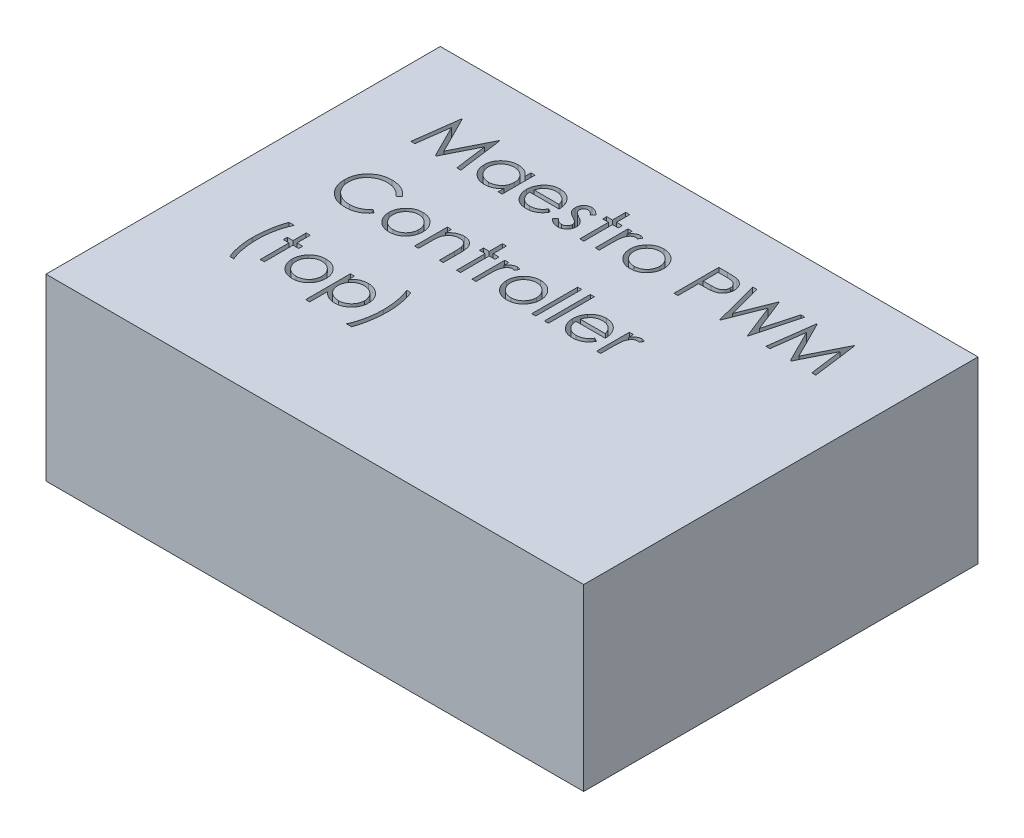
from build123d import *

# Parameters (mm, degrees)
SKETCH1_W           = 38.1
SKETCH1_H           = 27.94
BOSS_EXTRUDE1_DEPTH = 12.7
SKETCH2_W           = 0.284935898
SKETCH2_H           = 3.256410256
SKETCH2_W_2         = 0.284935897
CUT_EXTRUDE1_DEPTH  = 5.08


with BuildPart() as part:
    # Sketch1 → Boss-Extrude1 (new body)
    with BuildSketch(Plane(origin=(0, 0, 0), x_dir=(1, 0, 0), z_dir=(0, 1, 0))):
        with Locations((19.05, 13.97)):
            Rectangle(SKETCH1_W, SKETCH1_H)
    extrude(amount=BOSS_EXTRUDE1_DEPTH)

    # Sketch2 → Cut-Extrude1 (cut)
    # profile 1 of 25: a face of its own
    with BuildSketch(Plane(origin=(0, 12.7, 0), x_dir=(1, 0, 0), z_dir=(0, 1, 0))):
        Polygon((4.778778041, 21.073716255), (5.197913658, 24.248716255), (5.238618786, 24.248716255), (6.549451118, 21.64358805), (7.857103362, 24.248716255), (7.898444508, 24.248716255), (8.320124195, 21.073716255), (8.033916262, 21.073716255), (7.729899836, 23.358291576), (6.58379607, 21.073716255), (6.51955829, 21.073716255), (5.3690024, 23.363379717), (5.065621992, 21.073716255), align=None)
    # profile 2 of 25: a face of its own
    with BuildSketch(Plane(origin=(0, 12.7, 0), x_dir=(1, 0, 0), z_dir=(0, 1, 0))):
        with BuildLine():
            Line((11.250893426, 23.393908563), (11.250893426, 21.073716255))
            Line((11.250893426, 21.073716255), (10.965957528, 21.073716255))
            Line((10.965957528, 21.073716255), (10.965957528, 21.475043379))
            add(Edge.make_bspline(
                [(10.965957528, 21.475043379), (10.933827625, 21.438721747), (10.871125716, 21.367839626), (10.76640413, 21.275236513), (10.655398712, 21.198693321), (10.538648228, 21.136871612), (10.416258107, 21.090433104), (10.288499656, 21.057425659), (10.155320761, 21.036204109), (10.064377553, 21.034085003), (10.018291262, 21.033011127)],
                knots=[0, 0, 0, 0, 1.074387032, 2.096679803, 3.090159297, 4.057316773, 5.018401886, 5.985159533, 6.978961417, 8, 8, 8, 8], degree=3))
            add(Edge.make_bspline(
                [(10.018291262, 21.033011127), (9.977317476, 21.034123622), (9.896515354, 21.036317511), (9.777653263, 21.053337601), (9.663269579, 21.080670379), (9.553256217, 21.118680472), (9.448325056, 21.169100217), (9.347577683, 21.229462635), (9.251536027, 21.301345388), (9.161663988, 21.383521671), (9.07890353, 21.472779981), (9.006276519, 21.567980584), (8.945721939, 21.668711817), (8.895085152, 21.773698321), (8.856081325, 21.883748283), (8.828890957, 21.998481143), (8.811890694, 22.117761242), (8.809697712, 22.198986381), (8.808585734, 22.240172586)],
                knots=[0, 0, 0, 0, 1.033919861, 2.038935746, 3.024066025, 3.998881131, 4.97069526, 5.957263378, 6.95902576, 7.993208707, 9.027059324, 10.027763471, 11.009749337, 11.988697705, 12.965288445, 13.950418724, 14.960734635, 16, 16, 16, 16], degree=3))
            add(Edge.make_bspline(
                [(8.808585734, 22.240172586), (8.809722358, 22.280507517), (8.811969402, 22.3602475), (8.828709109, 22.477521747), (8.856858666, 22.590477598), (8.896362785, 22.698751396), (8.947019416, 22.802474156), (9.008639895, 22.901719236), (9.081228672, 22.996760047), (9.164914784, 23.085361802), (9.255569897, 23.167204788), (9.352551389, 23.238332994), (9.453446794, 23.299761849), (9.559821097, 23.348433217), (9.670099827, 23.387811476), (9.785264739, 23.415055669), (9.904836671, 23.431109667), (9.986017332, 23.43343446), (10.027195509, 23.434613691)],
                knots=[0, 0, 0, 0, 1.020392517, 2.01726096, 2.990465484, 3.961182959, 4.928053699, 5.906110375, 6.912531644, 7.948652711, 8.985773172, 9.998621852, 10.987621588, 11.969261332, 12.953316658, 13.946091881, 14.958173133, 16, 16, 16, 16], degree=3))
            add(Edge.make_bspline(
                [(10.027195509, 23.434613691), (10.074548238, 23.433309445), (10.167404706, 23.43075188), (10.3032294, 23.409467835), (10.431721176, 23.373510083), (10.55387191, 23.324599209), (10.669242961, 23.259603577), (10.776742097, 23.17761604), (10.877494356, 23.079153678), (10.935896478, 23.003524775), (10.965957528, 22.964596664)],
                knots=[0, 0, 0, 0, 1.038897134, 2.037228247, 3.008116434, 3.962042015, 4.918381754, 5.904844433, 6.921570401, 8, 8, 8, 8], degree=3))
            Line((10.965957528, 22.964596664), (10.965957528, 23.393908563))
            Line((10.965957528, 23.393908563), (11.250893426, 23.393908563))
        make_face()
        with BuildLine():
            add(Edge.make_bspline(
                [(10.031011615, 23.149677794), (9.989360751, 23.148195851), (9.907148571, 23.145270732), (9.786458655, 23.122434775), (9.670967201, 23.084439465), (9.561251834, 23.032476597), (9.459045666, 22.967136243), (9.367702121, 22.888104703), (9.286474099, 22.797538269), (9.218158745, 22.69584564), (9.162468795, 22.586826943), (9.12331013, 22.472867631), (9.097484456, 22.356023116), (9.094846012, 22.27677268), (9.093521631, 22.236992497)],
                knots=[0, 0, 0, 0, 1.031046209, 2.035121221, 3.029706178, 4.034933723, 5.034054252, 6.02443088, 7.017295772, 8.038157696, 9.050218397, 10.03989886, 11.016116709, 12, 12, 12, 12], degree=3))
            add(Edge.make_bspline(
                [(9.093521631, 22.236992497), (9.095213356, 22.197450043), (9.098590174, 22.118520127), (9.122856875, 22.001516318), (9.163569332, 21.887530152), (9.219124632, 21.777529108), (9.288690356, 21.675399245), (9.369325062, 21.58310642), (9.461808531, 21.503740865), (9.564249913, 21.437303923), (9.673658572, 21.383635065), (9.788715066, 21.346291949), (9.907256538, 21.322182105), (9.987858298, 21.319365901), (10.028467544, 21.317947025)],
                knots=[0, 0, 0, 0, 0.979072187, 1.954306742, 2.945804271, 3.96968567, 4.997920485, 5.998718438, 6.996577872, 8.005894225, 9.015743152, 10.005417472, 10.995077863, 12, 12, 12, 12], degree=3))
            add(Edge.make_bspline(
                [(10.028467544, 21.317947025), (10.069694015, 21.319452849), (10.151689375, 21.322447785), (10.272737346, 21.345381504), (10.390207777, 21.383271771), (10.502500477, 21.43579455), (10.607108681, 21.500888723), (10.700996042, 21.577095156), (10.780385527, 21.665725901), (10.847688823, 21.763131684), (10.900462237, 21.86991328), (10.938903376, 21.983609296), (10.961630848, 22.104223689), (10.96449536, 22.186650251), (10.965957528, 22.228724268)],
                knots=[0, 0, 0, 0, 1.01762866, 2.023962475, 3.030623092, 4.058876274, 5.077231937, 6.066672613, 7.034107872, 8.005628644, 8.981990164, 9.965428785, 10.961468474, 12, 12, 12, 12], degree=3))
            add(Edge.make_bspline(
                [(10.965957528, 22.228724268), (10.965086983, 22.260780729), (10.963373474, 22.323877988), (10.950282886, 22.416522236), (10.929459488, 22.505180687), (10.900116891, 22.589946555), (10.861571226, 22.670351176), (10.815082181, 22.746971873), (10.759832238, 22.819410143), (10.696710792, 22.886668501), (10.627618073, 22.948015363), (10.554507311, 23.002774353), (10.476512305, 23.047758454), (10.394944707, 23.08498875), (10.309662996, 23.114615264), (10.21997322, 23.134379815), (10.12682871, 23.147950964), (10.063286931, 23.149096123), (10.031011615, 23.149677794)],
                knots=[0, 0, 0, 0, 1.050140795, 2.067009409, 3.05949893, 4.030605086, 5.00011959, 5.97591094, 6.962425594, 7.979863591, 8.993523472, 9.986985069, 10.967611495, 11.937549037, 12.921786183, 13.919465291, 14.943216303, 16, 16, 16, 16], degree=3))
        make_face(mode=Mode.SUBTRACT)
    # profile 3 of 25: a face of its own
    with BuildSketch(Plane(origin=(0, 12.7, 0), x_dir=(1, 0, 0), z_dir=(0, 1, 0))):
        with BuildLine():
            Line((13.806412256, 21.806408563), (14.059547272, 21.673480879))
            add(Edge.make_bspline(
                [(14.059547272, 21.673480879), (14.039375503, 21.637700143), (14.00012923, 21.568084999), (13.932637123, 21.47244324), (13.861887171, 21.386402812), (13.784685715, 21.31226234), (13.703342506, 21.247627155), (13.617406455, 21.191077843), (13.52643017, 21.142891757), (13.430409348, 21.102294821), (13.328537613, 21.071080494), (13.220568094, 21.049033093), (13.106293952, 21.035404842), (13.027965632, 21.03382175), (12.987857568, 21.033011127)],
                knots=[0, 0, 0, 0, 1.120438281, 2.179929193, 3.190490725, 4.156257408, 5.095198341, 6.022838206, 6.959905092, 7.901321166, 8.864066838, 9.862729781, 10.905609505, 12, 12, 12, 12], degree=3))
            add(Edge.make_bspline(
                [(12.987857568, 21.033011127), (12.943278775, 21.034051779), (12.856318462, 21.03608179), (12.729735977, 21.053582811), (12.610556076, 21.082132736), (12.49878546, 21.122015763), (12.394697845, 21.17411055), (12.298086355, 21.237573794), (12.208442928, 21.312079482), (12.128592396, 21.39827297), (12.056706873, 21.490513032), (11.993274165, 21.586630155), (11.940244924, 21.686382509), (11.897107914, 21.789135056), (11.862269215, 21.894240159), (11.83798799, 22.002654134), (11.823991005, 22.114083556), (11.821846115, 22.189464711), (11.820765221, 22.227452233)],
                knots=[0, 0, 0, 0, 1.145258523, 2.234067595, 3.276747158, 4.290159414, 5.277019952, 6.260822364, 7.254936242, 8.264827045, 9.274100331, 10.257902744, 11.220704747, 12.172965371, 13.118907548, 14.062713208, 15.023725156, 16, 16, 16, 16], degree=3))
            add(Edge.make_bspline(
                [(11.820765221, 22.227452233), (11.821726013, 22.263098258), (11.823630177, 22.333743971), (11.835632391, 22.438306287), (11.856903343, 22.539932097), (11.886091865, 22.638705847), (11.923784782, 22.734462154), (11.969896866, 22.827259297), (12.024499952, 22.916998531), (12.066657306, 22.973607088), (12.087892625, 23.002121704)],
                knots=[0, 0, 0, 0, 1.024358464, 2.0301432, 3.019427413, 4.004406732, 4.986367066, 5.972626655, 6.978780325, 8, 8, 8, 8], degree=3))
            add(Edge.make_bspline(
                [(12.087892625, 23.002121704), (12.116656023, 23.036474179), (12.173271667, 23.10409093), (12.269026361, 23.192934983), (12.372712967, 23.267360407), (12.483032085, 23.329052595), (12.601265887, 23.375927975), (12.725825029, 23.410859853), (12.858127811, 23.430434192), (12.94857469, 23.433199012), (12.994853762, 23.434613691)],
                knots=[0, 0, 0, 0, 1.030682036, 2.02871468, 2.997146059, 3.962720338, 4.930598197, 5.918074684, 6.934738563, 8, 8, 8, 8], degree=3))
            add(Edge.make_bspline(
                [(12.994853762, 23.434613691), (13.042431233, 23.433385376), (13.135767385, 23.4309757), (13.271867952, 23.408636098), (13.400646602, 23.373209852), (13.522051802, 23.323177485), (13.636095861, 23.258625605), (13.742037492, 23.178668364), (13.841688507, 23.085760527), (13.899662718, 23.014311044), (13.929163658, 22.977953034)],
                knots=[0, 0, 0, 0, 1.056321875, 2.072262726, 3.055038591, 4.01806755, 4.982017516, 5.957941055, 6.960871419, 8, 8, 8, 8], degree=3))
            add(Edge.make_bspline(
                [(13.929163658, 22.977953034), (13.949235952, 22.950554071), (13.989246933, 22.895938521), (14.039363945, 22.806883257), (14.082868154, 22.713710075), (14.117641625, 22.614912877), (14.145798887, 22.511662258), (14.16617043, 22.403220092), (14.178117155, 22.289618672), (14.180465474, 22.212215297), (14.181662657, 22.172754717)],
                knots=[0, 0, 0, 0, 0.94817472, 1.890038105, 2.849395472, 3.817997239, 4.812318967, 5.836947057, 6.897266129, 8, 8, 8, 8], degree=3))
            Line((14.181662657, 22.172754717), (12.105701118, 22.172754717))
            add(Edge.make_bspline(
                [(12.105701118, 22.172754717), (12.107097761, 22.142183582), (12.109844203, 22.082066677), (12.122648655, 21.994100324), (12.142831471, 21.910304506), (12.171196978, 21.831307747), (12.205547616, 21.756078274), (12.247626087, 21.68517414), (12.297826968, 21.618918304), (12.353820996, 21.556718115), (12.416148147, 21.501327281), (12.481718924, 21.451750313), (12.551472373, 21.410198093), (12.624858491, 21.376470621), (12.701758611, 21.350067035), (12.782196959, 21.332044083), (12.86601525, 21.319972636), (12.923152309, 21.318630368), (12.952240581, 21.317947025)],
                knots=[0, 0, 0, 0, 1.094153842, 2.151609401, 3.174256925, 4.172055639, 5.149267565, 6.128595816, 7.11444997, 8.118368179, 9.117203808, 10.09244225, 11.054858984, 12.015122123, 12.976791628, 13.957293641, 14.960065497, 16, 16, 16, 16], degree=3))
            add(Edge.make_bspline(
                [(12.952240581, 21.317947025), (12.980680551, 21.318498619), (13.037110906, 21.319593088), (13.121149398, 21.330235607), (13.20382597, 21.347444357), (13.284798433, 21.370930277), (13.362423415, 21.399574992), (13.434310449, 21.434139728), (13.500423216, 21.472375569), (13.562215036, 21.516108632), (13.622150866, 21.569637487), (13.681607264, 21.636435605), (13.745358228, 21.715436434), (13.785263073, 21.774895717), (13.806412256, 21.806408563)],
                knots=[0, 0, 0, 0, 0.99110716, 1.966546729, 2.947904876, 3.932708344, 4.903319531, 5.828989031, 6.710028674, 7.56322171, 8.463672341, 9.504779593, 10.677557249, 12, 12, 12, 12], degree=3))
        make_face()
        with BuildLine():
            add(Edge.make_bspline(
                [(13.896726759, 22.457690614), (13.886297678, 22.495484793), (13.866225055, 22.56822642), (13.824282067, 22.668956371), (13.777045741, 22.758480395), (13.721146027, 22.836113348), (13.657810469, 22.905059392), (13.584653768, 22.965310537), (13.502615493, 23.019210653), (13.412119701, 23.064706135), (13.31628751, 23.103431935), (13.215951893, 23.129399005), (13.113573757, 23.147187661), (13.044327655, 23.148844202), (13.009482168, 23.149677794)],
                knots=[0, 0, 0, 0, 1.154881502, 2.222775134, 3.210006277, 4.132804581, 5.035138423, 5.962687519, 6.919655026, 7.923214229, 8.944639381, 9.960483929, 10.97369054, 12, 12, 12, 12], degree=3))
            add(Edge.make_bspline(
                [(13.009482168, 23.149677794), (12.981043749, 23.14912292), (12.924826973, 23.148026052), (12.842003861, 23.137621006), (12.762465848, 23.120421719), (12.685626052, 23.096867794), (12.612491407, 23.065472847), (12.541557581, 23.028658063), (12.474628222, 22.983716769), (12.432771475, 22.949464094), (12.411625597, 22.932159765)],
                knots=[0, 0, 0, 0, 1.04873581, 2.073130211, 3.073294108, 4.04793562, 5.032784715, 6.005352987, 6.992311501, 8, 8, 8, 8], degree=3))
            add(Edge.make_bspline(
                [(12.411625597, 22.932159765), (12.396482406, 22.918467064), (12.365836277, 22.890756376), (12.324887375, 22.843014167), (12.285680232, 22.791532393), (12.24999899, 22.734341458), (12.217271465, 22.672092609), (12.186646343, 22.605310897), (12.159081526, 22.533489557), (12.143572912, 22.483440273), (12.135593947, 22.457690614)],
                knots=[0, 0, 0, 0, 0.879870761, 1.780643979, 2.707998968, 3.669668524, 4.684282772, 5.740141944, 6.837334558, 8, 8, 8, 8], degree=3))
            Line((12.135593947, 22.457690614), (13.896726759, 22.457690614))
        make_face(mode=Mode.SUBTRACT)
    # profile 4 of 25: a face of its own
    with BuildSketch(Plane(origin=(0, 12.7, 0), x_dir=(1, 0, 0), z_dir=(0, 1, 0))):
        with BuildLine():
            Line((15.850572913, 23.104520542), (15.657223554, 22.905447025))
            add(Edge.make_bspline(
                [(15.657223554, 22.905447025), (15.64054074, 22.924781093), (15.608378239, 22.962054901), (15.557368253, 23.011890669), (15.506546841, 23.053743463), (15.456609703, 23.089078727), (15.40630113, 23.11579331), (15.356211497, 23.13529222), (15.306288942, 23.147358858), (15.272918752, 23.148914099), (15.256532448, 23.149677794)],
                knots=[0, 0, 0, 0, 1.26578478, 2.440284043, 3.530471711, 4.527705817, 5.468200915, 6.346673037, 7.188140097, 8, 8, 8, 8], degree=3))
            add(Edge.make_bspline(
                [(15.256532448, 23.149677794), (15.236448859, 23.148702731), (15.196927197, 23.146783944), (15.140298062, 23.127631046), (15.087728567, 23.098231691), (15.04222902, 23.056531619), (15.003686625, 23.008666889), (14.975552786, 22.955148794), (14.958347929, 22.897592355), (14.956166494, 22.857650984), (14.955060093, 22.837393138)],
                knots=[0, 0, 0, 0, 0.99966794, 1.967205029, 2.953328237, 3.988086729, 5.028030931, 6.008226631, 6.989793394, 8, 8, 8, 8], degree=3))
            add(Edge.make_bspline(
                [(14.955060093, 22.837393138), (14.956067758, 22.819057927), (14.958080248, 22.782439191), (14.97372545, 22.728420617), (14.998641101, 22.67575459), (15.021927635, 22.643493953), (15.033926278, 22.626871304)],
                knots=[0, 0, 0, 0, 0.960159726, 1.917612774, 2.927026955, 4, 4, 4, 4], degree=3))
            add(Edge.make_bspline(
                [(15.033926278, 22.626871304), (15.041150305, 22.617995288), (15.056525735, 22.599103807), (15.085380602, 22.572883883), (15.118058158, 22.543907698), (15.15735553, 22.514936424), (15.201579677, 22.484427645), (15.251689599, 22.453582853), (15.306095043, 22.420050839), (15.345045314, 22.398783387), (15.365291463, 22.387728675)],
                knots=[0, 0, 0, 0, 0.66740084, 1.420478572, 2.27185888, 3.217733974, 4.268547843, 5.408967954, 6.65319498, 8, 8, 8, 8], degree=3))
            add(Edge.make_bspline(
                [(15.365291463, 22.387728675), (15.389978065, 22.373899371), (15.437664451, 22.347185708), (15.505421461, 22.305720477), (15.566913992, 22.264507685), (15.622663061, 22.223988086), (15.671595988, 22.183027985), (15.715197404, 22.143197377), (15.752379778, 22.10329279), (15.773202268, 22.075413465), (15.783155044, 22.06208765)],
                knots=[0, 0, 0, 0, 1.27191281, 2.456916733, 3.569705269, 4.599008579, 5.553216877, 6.436649441, 7.252746552, 8, 8, 8, 8], degree=3))
            add(Edge.make_bspline(
                [(15.783155044, 22.06208765), (15.799674594, 22.03517627), (15.832551564, 21.981617629), (15.867075849, 21.893426627), (15.88708767, 21.799890671), (15.889865541, 21.735907872), (15.891278041, 21.703373707)],
                knots=[0, 0, 0, 0, 0.995354457, 1.980940102, 2.973342416, 4, 4, 4, 4], degree=3))
            add(Edge.make_bspline(
                [(15.891278041, 21.703373707), (15.890625321, 21.680450982), (15.889339065, 21.635279247), (15.88039639, 21.56875408), (15.865015805, 21.505132017), (15.844066471, 21.443722723), (15.81577779, 21.385702828), (15.782623716, 21.329608516), (15.742822904, 21.276653208), (15.69738287, 21.226906437), (15.647630172, 21.181471509), (15.594556746, 21.141535494), (15.538097236, 21.108357345), (15.478655066, 21.080902353), (15.41609518, 21.059069005), (15.350407796, 21.043953709), (15.281801711, 21.03490699), (15.235147528, 21.033651072), (15.211375197, 21.033011127)],
                knots=[0, 0, 0, 0, 1.032770009, 2.035186124, 3.017557409, 3.978232242, 4.952395191, 5.920591857, 6.910227898, 7.931268572, 8.952309245, 9.941945286, 10.918353717, 11.897095711, 12.887975737, 13.898235213, 14.929059601, 16, 16, 16, 16], degree=3))
            add(Edge.make_bspline(
                [(15.211375197, 21.033011127), (15.179292116, 21.033911648), (15.115571747, 21.035700178), (15.02132893, 21.052487819), (14.929235099, 21.078609355), (14.839987173, 21.114637381), (14.755581055, 21.160131242), (14.678355145, 21.214616413), (14.608041176, 21.276293054), (14.568019599, 21.323566908), (14.54800881, 21.347203836)],
                knots=[0, 0, 0, 0, 1.013940152, 2.01379169, 3.017749504, 4.037548394, 5.051665909, 6.043208538, 7.021604269, 8, 8, 8, 8], degree=3))
            Line((14.54800881, 21.347203836), (14.736906046, 21.562177794))
            add(Edge.make_bspline(
                [(14.736906046, 21.562177794), (14.754842449, 21.542805972), (14.789614879, 21.505250766), (14.84522384, 21.455245114), (14.901810868, 21.413333961), (14.958810905, 21.378278863), (15.017067705, 21.351268319), (15.076254798, 21.332292166), (15.136251797, 21.320096363), (15.17654902, 21.318664635), (15.196746791, 21.317947025)],
                knots=[0, 0, 0, 0, 1.179806542, 2.287233372, 3.337373186, 4.324005949, 5.273901747, 6.200048787, 7.097828587, 8, 8, 8, 8], degree=3))
            add(Edge.make_bspline(
                [(15.196746791, 21.317947025), (15.224249481, 21.319190559), (15.277985124, 21.321620215), (15.354950534, 21.343679292), (15.426014859, 21.378268605), (15.487721751, 21.427331153), (15.540247283, 21.484440851), (15.578282127, 21.548770088), (15.602118372, 21.618430909), (15.604917813, 21.666720212), (15.606342144, 21.691289372)],
                knots=[0, 0, 0, 0, 1.072336372, 2.095165389, 3.102688358, 4.141489647, 5.156069229, 6.117746104, 7.042326257, 8, 8, 8, 8], degree=3))
            add(Edge.make_bspline(
                [(15.606342144, 21.691289372), (15.60535672, 21.711527384), (15.603411132, 21.751484628), (15.588131878, 21.809315294), (15.563990219, 21.86416957), (15.540218859, 21.896273036), (15.528111976, 21.912623507)],
                knots=[0, 0, 0, 0, 1.013901739, 2.00181326, 2.98231254, 4, 4, 4, 4], degree=3))
            add(Edge.make_bspline(
                [(15.528111976, 21.912623507), (15.520834518, 21.920819871), (15.504981586, 21.938674513), (15.475902903, 21.96446012), (15.441085071, 21.992253253), (15.400136495, 22.021582623), (15.352974626, 22.052061358), (15.299408316, 22.083529556), (15.240171386, 22.11748185), (15.198288028, 22.139996823), (15.176394227, 22.151766135)],
                knots=[0, 0, 0, 0, 0.615000592, 1.339693406, 2.178160186, 3.116406724, 4.166410947, 5.330106347, 6.604359322, 8, 8, 8, 8], degree=3))
            add(Edge.make_bspline(
                [(15.176394227, 22.151766135), (15.152766204, 22.164955205), (15.106943926, 22.190533019), (15.042040312, 22.230371178), (14.98348664, 22.270890777), (14.929873976, 22.309818853), (14.882556493, 22.349207852), (14.841720597, 22.389101501), (14.805758537, 22.427890917), (14.785849099, 22.455374894), (14.776339139, 22.468502914)],
                knots=[0, 0, 0, 0, 1.262093308, 2.447601706, 3.550203992, 4.582594899, 5.537233252, 6.418365656, 7.244515135, 8, 8, 8, 8], degree=3))
            add(Edge.make_bspline(
                [(14.776339139, 22.468502914), (14.759892095, 22.494942151), (14.726992259, 22.547829863), (14.69504705, 22.636104367), (14.673088724, 22.729036669), (14.671127127, 22.793159744), (14.670124195, 22.825944821)],
                knots=[0, 0, 0, 0, 0.985009483, 1.970363186, 2.962279964, 4, 4, 4, 4], degree=3))
            add(Edge.make_bspline(
                [(14.670124195, 22.825944821), (14.670608787, 22.847376432), (14.671557201, 22.889321131), (14.679126447, 22.950951347), (14.6929075, 23.009505744), (14.710193037, 23.065863684), (14.734216905, 23.11893344), (14.762924262, 23.169422718), (14.796658569, 23.217261729), (14.835523554, 23.26171457), (14.878256011, 23.302090888), (14.924424838, 23.337286786), (14.972991685, 23.367318979), (15.02416218, 23.392505946), (15.078427894, 23.4115572), (15.135409516, 23.424672114), (15.194991707, 23.433430762), (15.235723442, 23.434213703), (15.256532448, 23.434613691)],
                knots=[0, 0, 0, 0, 1.087655834, 2.128696564, 3.144119009, 4.137814668, 5.115653402, 6.093965665, 7.082169637, 8.081268856, 9.086088321, 10.061021666, 11.022561449, 11.980240094, 12.950172527, 13.934149372, 14.944599409, 16, 16, 16, 16], degree=3))
            add(Edge.make_bspline(
                [(15.256532448, 23.434613691), (15.281199534, 23.433611897), (15.330996436, 23.431589514), (15.405703846, 23.415527924), (15.480301235, 23.389100036), (15.554980274, 23.352600025), (15.629193894, 23.30536793), (15.7035949, 23.248282066), (15.77907647, 23.181717996), (15.826208268, 23.130827985), (15.850572913, 23.104520542)],
                knots=[0, 0, 0, 0, 0.845714091, 1.707292901, 2.609013841, 3.555613372, 4.552488639, 5.621697636, 6.770543573, 8, 8, 8, 8], degree=3))
        make_face()
    # profile 5 of 25: a face of its own
    with BuildSketch(Plane(origin=(0, 12.7, 0), x_dir=(1, 0, 0), z_dir=(0, 1, 0))):
        Polygon((16.746085734, 24.330126512), (17.031021631, 24.330126512), (17.031021631, 23.393908563), (17.438072913, 23.393908563), (17.438072913, 23.108972666), (17.031021631, 23.108972666), (17.031021631, 21.073716255), (16.746085734, 21.073716255), (16.746085734, 23.108972666), (16.339034451, 23.108972666), (16.339034451, 23.393908563), (16.746085734, 23.393908563), align=None)
    # profile 6 of 25: a face of its own
    with BuildSketch(Plane(origin=(0, 12.7, 0), x_dir=(1, 0, 0), z_dir=(0, 1, 0))):
        with BuildLine():
            Line((17.845124195, 23.393908563), (18.130060093, 23.393908563))
            Line((18.130060093, 23.393908563), (18.130060093, 23.052367097))
            add(Edge.make_bspline(
                [(18.130060093, 23.052367097), (18.151095609, 23.084167741), (18.191325872, 23.144986226), (18.258194029, 23.225421949), (18.326686337, 23.292019884), (18.397130685, 23.345090934), (18.470045105, 23.384835691), (18.543829339, 23.413948659), (18.61964423, 23.431163795), (18.670591118, 23.433462185), (18.696115782, 23.434613691)],
                knots=[0, 0, 0, 0, 1.2804753, 2.448899062, 3.506932113, 4.484331642, 5.4025378, 6.288909075, 7.142734305, 8, 8, 8, 8], degree=3))
            add(Edge.make_bspline(
                [(18.696115782, 23.434613691), (18.715915378, 23.433533714), (18.756654334, 23.431311589), (18.818324254, 23.415698913), (18.881863671, 23.390772421), (18.922814266, 23.367331647), (18.944162657, 23.355111488)],
                knots=[0, 0, 0, 0, 0.901110191, 1.854092781, 2.881294221, 4, 4, 4, 4], degree=3))
            Line((18.944162657, 23.355111488), (18.78770232, 23.108336648))
            add(Edge.make_bspline(
                [(18.78770232, 23.108336648), (18.773996279, 23.114451032), (18.747979591, 23.126057304), (18.709920805, 23.139793271), (18.674831307, 23.14788128), (18.652476079, 23.149106574), (18.642054283, 23.149677794)],
                knots=[0, 0, 0, 0, 1.180555205, 2.24091978, 3.179933427, 4, 4, 4, 4], degree=3))
            add(Edge.make_bspline(
                [(18.642054283, 23.149677794), (18.619189082, 23.14815376), (18.5725507, 23.145045173), (18.504075475, 23.120607826), (18.437629796, 23.081124215), (18.384859788, 23.037335421), (18.34400003, 22.995109919), (18.314844254, 22.958236011), (18.288099191, 22.916889681), (18.262544777, 22.871777753), (18.239261781, 22.822129964), (18.217531474, 22.768442335), (18.197883791, 22.710652682), (18.186680355, 22.670391396), (18.180941503, 22.649767938)],
                knots=[0, 0, 0, 0, 1.125678352, 2.296057538, 3.5422874, 4.923748041, 5.663163013, 6.437101912, 7.23742474, 8.08941207, 8.991984279, 9.93940061, 10.944477711, 12, 12, 12, 12], degree=3))
            add(Edge.make_bspline(
                [(18.180941503, 22.649767938), (18.176648546, 22.631373645), (18.167139973, 22.590631683), (18.157894792, 22.522279807), (18.148760301, 22.441522631), (18.142322654, 22.348135365), (18.13635543, 22.242351219), (18.132989856, 22.12400904), (18.130174864, 21.992987357), (18.13009951, 21.901389194), (18.130060093, 21.853473868)],
                knots=[0, 0, 0, 0, 0.566838948, 1.255505196, 2.06880316, 3.007127437, 4.065329342, 5.249902469, 6.561414163, 8, 8, 8, 8], degree=3))
            Line((18.130060093, 21.853473868), (18.130060093, 21.073716255))
            Line((18.130060093, 21.073716255), (17.845124195, 21.073716255))
            Line((17.845124195, 21.073716255), (17.845124195, 23.393908563))
        make_face()
    # profile 7 of 25: a face of its own
    with BuildSketch(Plane(origin=(0, 12.7, 0), x_dir=(1, 0, 0), z_dir=(0, 1, 0))):
        with BuildLine():
            add(Edge.make_bspline(
                [(20.349761615, 23.434613691), (20.393296555, 23.43368669), (20.478657934, 23.431869067), (20.603669373, 23.412442634), (20.722999604, 23.382736096), (20.83710565, 23.341668322), (20.944526146, 23.286621124), (21.046825775, 23.220935553), (21.143724061, 23.143118486), (21.201802095, 23.082922238), (21.231282048, 23.052367097)],
                knots=[0, 0, 0, 0, 1.054011418, 2.066658804, 3.057071809, 4.030435133, 4.997543892, 5.974964718, 6.972108034, 8, 8, 8, 8], degree=3))
            add(Edge.make_bspline(
                [(21.231282048, 23.052367097), (21.256665677, 23.02314441), (21.306941694, 22.965264575), (21.371408453, 22.871415555), (21.426945154, 22.774224178), (21.471452269, 22.672399817), (21.506545111, 22.566831365), (21.531460422, 22.45715597), (21.546280355, 22.34361584), (21.548278761, 22.266505216), (21.549290862, 22.227452233)],
                knots=[0, 0, 0, 0, 1.025258237, 2.030674902, 3.01204498, 3.988269485, 4.97094183, 5.956517959, 6.965070386, 8, 8, 8, 8], degree=3))
            add(Edge.make_bspline(
                [(21.549290862, 22.227452233), (21.548400649, 22.188172895), (21.546641546, 22.110555091), (21.530001265, 21.996237524), (21.504119495, 21.885389363), (21.467079184, 21.778474691), (21.419582899, 21.675166697), (21.361624919, 21.575916606), (21.292798523, 21.4805286), (21.214780612, 21.389812646), (21.128554981, 21.306204723), (21.035013904, 21.233335507), (20.935995602, 21.170904553), (20.830183417, 21.120615804), (20.718543625, 21.080964862), (20.600835428, 21.053115561), (20.477241685, 21.036277462), (20.392852706, 21.034115221), (20.349761615, 21.033011127)],
                knots=[0, 0, 0, 0, 0.998656419, 1.973391657, 2.932242238, 3.890759089, 4.846373663, 5.82037756, 6.809684879, 7.83454468, 8.860553229, 9.859544525, 10.845671541, 11.83227036, 12.833544569, 13.85385346, 14.904124723, 16, 16, 16, 16], degree=3))
            add(Edge.make_bspline(
                [(20.349761615, 21.033011127), (20.306459405, 21.034118927), (20.221649839, 21.036288608), (20.097619842, 21.053050143), (19.979700687, 21.080952027), (19.867914744, 21.12074611), (19.761647633, 21.17090616), (19.662055597, 21.233146764), (19.56843853, 21.306226334), (19.482194659, 21.389806791), (19.404181638, 21.480530108), (19.335353981, 21.575916215), (19.277396328, 21.675166799), (19.229899957, 21.778474664), (19.19285967, 21.88538937), (19.166977893, 21.996237522), (19.150337614, 22.110555092), (19.148578511, 22.188172895), (19.147688298, 22.227452233)],
                knots=[0, 0, 0, 0, 1.099876186, 2.154163076, 3.173186993, 4.173200201, 5.163417411, 6.152872554, 7.150605724, 8.17532212, 9.198891216, 10.186952605, 11.159729845, 12.11414092, 13.071450619, 14.029093627, 15.002601286, 16, 16, 16, 16], degree=3))
            add(Edge.make_bspline(
                [(19.147688298, 22.227452233), (19.148707301, 22.266292957), (19.150724751, 22.343190915), (19.165529785, 22.456517605), (19.190347904, 22.56600738), (19.225482813, 22.671168347), (19.270400165, 22.772546493), (19.325156476, 22.869978018), (19.390280836, 22.963402666), (19.440356892, 23.021207695), (19.465697112, 23.050459044)],
                knots=[0, 0, 0, 0, 1.031353054, 2.041901799, 3.029428768, 4.008703097, 4.981709435, 5.96992636, 6.972712378, 8, 8, 8, 8], degree=3))
            add(Edge.make_bspline(
                [(19.465697112, 23.050459044), (19.495132619, 23.081279167), (19.553022724, 23.141892363), (19.650403356, 23.219482582), (19.752451322, 23.28653502), (19.861058934, 23.340488444), (19.975071241, 23.382977671), (20.095012982, 23.412519245), (20.220448628, 23.431799074), (20.306227713, 23.433666136), (20.349761615, 23.434613691)],
                knots=[0, 0, 0, 0, 1.027980169, 2.021703884, 2.998553061, 3.971491411, 4.943284454, 5.930300938, 6.949603206, 8, 8, 8, 8], degree=3))
        make_face()
        with BuildLine():
            add(Edge.make_bspline(
                [(20.34848958, 23.149677794), (20.317703318, 23.148802771), (20.256925537, 23.147075315), (20.167463485, 23.133936344), (20.081339203, 23.11311968), (19.998389294, 23.083543143), (19.918893488, 23.045353428), (19.842775673, 22.998446558), (19.769811959, 22.943443805), (19.701429659, 22.880431238), (19.638671419, 22.811598151), (19.583809254, 22.738257139), (19.537159336, 22.661597811), (19.498297192, 22.581540448), (19.469352814, 22.497273758), (19.448331572, 22.409752043), (19.435204997, 22.318796986), (19.433493782, 22.256965205), (19.432624195, 22.22554418)],
                knots=[0, 0, 0, 0, 1.021534396, 2.016698045, 2.994645724, 3.958388632, 4.93408049, 5.916473867, 6.921342795, 7.962252576, 8.998418191, 10.008913653, 10.997312074, 11.973003931, 12.956656626, 13.948281152, 14.957379055, 16, 16, 16, 16], degree=3))
            add(Edge.make_bspline(
                [(19.432624195, 22.22554418), (19.434081814, 22.184947698), (19.436974914, 22.104371273), (19.460501878, 21.985706898), (19.499859432, 21.871786218), (19.553006465, 21.763277068), (19.619596392, 21.662881501), (19.698052516, 21.573372369), (19.787532816, 21.496096668), (19.886970641, 21.431979044), (19.994334915, 21.381034123), (20.107960292, 21.344930766), (20.226470065, 21.321461445), (20.307460442, 21.319128751), (20.34848958, 21.317947025)],
                knots=[0, 0, 0, 0, 1.016792936, 2.018143844, 3.017858371, 4.030088057, 5.03801393, 6.028138512, 7.003788237, 7.991172063, 8.984598303, 9.972568034, 10.972917682, 12, 12, 12, 12], degree=3))
            add(Edge.make_bspline(
                [(20.34848958, 21.317947025), (20.389516357, 21.319135636), (20.470502076, 21.321481922), (20.588847187, 21.344812566), (20.702162004, 21.381192315), (20.809414763, 21.431921748), (20.908807325, 21.496340153), (20.99893117, 21.572936009), (21.07671741, 21.663118574), (21.143241466, 21.763410047), (21.197258869, 21.871617995), (21.236432202, 21.985727923), (21.260015726, 22.104365919), (21.262901192, 22.184945904), (21.264354964, 22.22554418)],
                knots=[0, 0, 0, 0, 1.02726834, 2.027799167, 3.010890988, 4.004497153, 4.992059811, 5.971914811, 6.958719428, 7.966827853, 8.981595046, 9.981490638, 10.983022906, 12, 12, 12, 12], degree=3))
            add(Edge.make_bspline(
                [(21.264354964, 22.22554418), (21.263485676, 22.256965393), (21.261775051, 22.318797544), (21.24864419, 22.409749912), (21.227638808, 22.497281575), (21.198635984, 22.581511606), (21.1599427, 22.661805093), (21.11239318, 22.738032059), (21.057755036, 22.811852212), (20.994239505, 22.880208729), (20.925928583, 22.943468369), (20.852935299, 22.998467887), (20.776930354, 23.045147277), (20.697665497, 23.083869795), (20.614704953, 23.112850597), (20.528701343, 23.134056541), (20.439620994, 23.147019791), (20.379061005, 23.148786126), (20.34848958, 23.149677794)],
                knots=[0, 0, 0, 0, 1.042956736, 2.052379634, 3.044323526, 4.02829302, 5.004299113, 5.996692471, 7.007513377, 8.048758398, 9.090003419, 10.095195979, 11.07790575, 12.047570684, 13.018257071, 13.989683339, 14.985167495, 16, 16, 16, 16], degree=3))
        make_face(mode=Mode.SUBTRACT)
    # profile 8 of 25: a face of its own
    with BuildSketch(Plane(origin=(0, 12.7, 0), x_dir=(1, 0, 0), z_dir=(0, 1, 0))):
        with BuildLine():
            Line((23.421726759, 24.248716255), (24.044388017, 24.248716255))
            add(Edge.make_bspline(
                [(24.044388017, 24.248716255), (24.087215053, 24.248669178), (24.169273557, 24.248578976), (24.286943643, 24.245844171), (24.3938139, 24.242191386), (24.489653888, 24.237127811), (24.574758491, 24.231143762), (24.648742613, 24.22275084), (24.712187782, 24.213987572), (24.750202918, 24.205078153), (24.76754006, 24.201014933)],
                knots=[0, 0, 0, 0, 1.415646017, 2.712440637, 3.8905458, 4.950247383, 5.884950622, 6.709939814, 7.411656543, 8, 8, 8, 8], degree=3))
            add(Edge.make_bspline(
                [(24.76754006, 24.201014933), (24.789487052, 24.195007879), (24.832863881, 24.183135319), (24.89536697, 24.159355727), (24.954833673, 24.131159762), (25.011468015, 24.099025188), (25.064574048, 24.061573284), (25.114944099, 24.020322216), (25.162133653, 23.974319579), (25.205877344, 23.924081337), (25.246049982, 23.87045086), (25.280639051, 23.812627552), (25.309601607, 23.751584727), (25.334442146, 23.687364844), (25.35232053, 23.619428622), (25.365788789, 23.548248105), (25.374337365, 23.473830921), (25.375156118, 23.422976613), (25.375572913, 23.397088651)],
                knots=[0, 0, 0, 0, 0.999701418, 1.975846123, 2.934577507, 3.890451536, 4.834027766, 5.787354733, 6.749476667, 7.726910423, 8.712836071, 9.690891519, 10.682875813, 11.679750201, 12.712814741, 13.765529915, 14.8625177, 16, 16, 16, 16], degree=3))
            add(Edge.make_bspline(
                [(25.375572913, 23.397088651), (25.375190621, 23.370983097), (25.37444264, 23.319905816), (25.365465295, 23.245181929), (25.353372907, 23.173773104), (25.334779152, 23.105837674), (25.310426292, 23.041779082), (25.281858501, 22.980618393), (25.247402013, 22.923396119), (25.207809917, 22.86990452), (25.163766685, 22.820093385), (25.115458663, 22.774323679), (25.063080876, 22.732863315), (25.006799784, 22.695619346), (24.946066707, 22.663455435), (24.881802754, 22.634647023), (24.813449343, 22.61045256), (24.766148634, 22.59772529), (24.742099355, 22.591254316)],
                knots=[0, 0, 0, 0, 1.121902311, 2.195077645, 3.232258892, 4.234102512, 5.217864754, 6.176164875, 7.132989551, 8.084763148, 9.034132444, 9.988522005, 10.94243251, 11.903244335, 12.886203696, 13.894208494, 14.929344452, 16, 16, 16, 16], degree=3))
            add(Edge.make_bspline(
                [(24.742099355, 22.591254316), (24.722208131, 22.587024326), (24.678615356, 22.577754057), (24.606821601, 22.567404957), (24.523232572, 22.558571562), (24.427962361, 22.551948388), (24.321096483, 22.54627841), (24.202577128, 22.54177164), (24.072171644, 22.539295272), (23.981211301, 22.539167553), (23.93372095, 22.539100871)],
                knots=[0, 0, 0, 0, 0.601384939, 1.31797006, 2.144135048, 3.087295005, 4.142315834, 5.309527816, 6.595305764, 8, 8, 8, 8], degree=3))
            Line((23.93372095, 22.539100871), (23.706662657, 22.539100871))
            Line((23.706662657, 22.539100871), (23.706662657, 21.073716255))
            Line((23.706662657, 21.073716255), (23.421726759, 21.073716255))
            Line((23.421726759, 21.073716255), (23.421726759, 24.248716255))
        make_face()
        with BuildLine():
            Line((23.706662657, 23.92307523), (23.706662657, 22.864741897))
            Line((23.706662657, 22.864741897), (24.262542064, 22.857745703))
            add(Edge.make_bspline(
                [(24.262542064, 22.857745703), (24.289683711, 22.857731675), (24.342080101, 22.857704595), (24.417768675, 22.861319762), (24.487989957, 22.865493102), (24.55252825, 22.871603547), (24.611412648, 22.880240688), (24.664741335, 22.888959907), (24.712100798, 22.901574057), (24.767526503, 22.918558556), (24.829287825, 22.947526), (24.896477673, 22.989571972), (24.953419562, 23.043166614), (25.002694017, 23.103426147), (25.041797206, 23.170463214), (25.070422999, 23.242190035), (25.087242477, 23.317871013), (25.08949781, 23.369658111), (25.090637016, 23.395816616)],
                knots=[0, 0, 0, 0, 1.160613943, 2.240541288, 3.23993089, 4.169200891, 5.011653406, 5.7853311, 6.478053781, 7.106038997, 8.262395093, 9.384106736, 10.481365981, 11.59014053, 12.70357646, 13.786202915, 14.881775077, 16, 16, 16, 16], degree=3))
            add(Edge.make_bspline(
                [(25.090637016, 23.395816616), (25.089491615, 23.421342268), (25.0872147, 23.472084103), (25.070291167, 23.546450551), (25.041852861, 23.617421511), (25.002431521, 23.683618524), (24.954587782, 23.743661225), (24.898980521, 23.795819333), (24.835740634, 23.837749021), (24.776914024, 23.864812069), (24.72466152, 23.881335926), (24.679275385, 23.892897317), (24.628030273, 23.902128045), (24.570909501, 23.909602451), (24.508355802, 23.916000948), (24.439831759, 23.920342514), (24.365596954, 23.922883835), (24.314061651, 23.923009887), (24.287346751, 23.92307523)],
                knots=[0, 0, 0, 0, 1.120700087, 2.227813068, 3.331159281, 4.466773991, 5.599788987, 6.693661531, 7.80175334, 8.91857717, 9.525282508, 10.207424825, 10.974604443, 11.810962634, 12.737642355, 13.736264703, 14.826523623, 16, 16, 16, 16], degree=3))
            Line((24.287346751, 23.92307523), (23.706662657, 23.92307523))
        make_face(mode=Mode.SUBTRACT)
    # profile 9 of 25: a face of its own
    with BuildSketch(Plane(origin=(0, 12.7, 0), x_dir=(1, 0, 0), z_dir=(0, 1, 0))):
        Polygon((25.823329323, 24.248716255), (26.117805485, 24.248716255), (26.739194708, 21.920255719), (27.663328322, 24.248716255), (27.704669468, 24.248716255), (28.611630605, 21.936156159), (29.236199916, 24.248716255), (29.52749599, 24.248716255), (28.671416262, 21.073716255), (28.630711134, 21.073716255), (27.675412657, 23.50203156), (26.708665862, 21.073716255), (26.667960734, 21.073716255), align=None)
    # profile 10 of 25: a face of its own
    with BuildSketch(Plane(origin=(0, 12.7, 0), x_dir=(1, 0, 0), z_dir=(0, 1, 0))):
        Polygon((29.934547272, 21.073716255), (30.353682889, 24.248716255), (30.394388017, 24.248716255), (31.705220349, 21.64358805), (33.012872593, 24.248716255), (33.054213738, 24.248716255), (33.475893426, 21.073716255), (33.189685493, 21.073716255), (32.885669067, 23.358291576), (31.739565301, 21.073716255), (31.67532752, 21.073716255), (30.524771631, 23.363379717), (30.221391222, 21.073716255), align=None)
    # profile 11 of 25: a face of its own
    with BuildSketch(Plane(origin=(0, 12.7, 0), x_dir=(1, 0, 0), z_dir=(0, 1, 0))):
        with BuildLine():
            Line((7.872367785, 17.374457441), (7.623048875, 17.183652153))
            add(Edge.make_bspline(
                [(7.623048875, 17.183652153), (7.605263533, 17.204848426), (7.569932635, 17.246955199), (7.513091787, 17.306082357), (7.453853868, 17.361477273), (7.392241522, 17.413403835), (7.32714575, 17.460046187), (7.260143454, 17.503834973), (7.190113798, 17.543084993), (7.093274725, 17.590676416), (6.966594177, 17.640338999), (6.807123144, 17.681979788), (6.640652362, 17.708487568), (6.527080254, 17.711358532), (6.469312897, 17.71281882)],
                knots=[0, 0, 0, 0, 0.757959112, 1.505699292, 2.245454638, 2.979532153, 3.711538275, 4.438200793, 5.171680507, 5.909471876, 7.393775596, 8.890124382, 10.418191784, 12, 12, 12, 12], degree=3))
            add(Edge.make_bspline(
                [(6.469312897, 17.71281882), (6.437487333, 17.712452368), (6.374131575, 17.711722865), (6.280107603, 17.702098873), (6.187839335, 17.688572276), (6.09738679, 17.668501447), (6.008865107, 17.643126285), (5.921695571, 17.61280466), (5.837140241, 17.575289912), (5.75402941, 17.533825991), (5.674401126, 17.486992523), (5.599058333, 17.435908268), (5.528275819, 17.381144873), (5.461997592, 17.322497084), (5.400155896, 17.26022902), (5.343198836, 17.193677081), (5.291323499, 17.123054038), (5.243501627, 17.049291161), (5.200672933, 16.972603307), (5.164813685, 16.892706636), (5.133059038, 16.810969343), (5.107931868, 16.726467933), (5.088043199, 16.639796995), (5.074320248, 16.550723923), (5.064805706, 16.4594348), (5.064079831, 16.397559209), (5.063713939, 16.366369501)],
                knots=[0, 0, 0, 0, 1.054917814, 2.100044995, 3.131103042, 4.146048494, 5.169673617, 6.183595914, 7.203665975, 8.234915748, 9.262203917, 10.264457458, 11.251630812, 12.227803204, 13.197192746, 14.159520551, 15.12972552, 16.100847026, 17.073214652, 18.039054194, 19.002613845, 19.979014051, 20.95965708, 21.949030935, 22.966165397, 24, 24, 24, 24], degree=3))
            add(Edge.make_bspline(
                [(5.063713939, 16.366369501), (5.064858589, 16.319441803), (5.067105957, 16.227305494), (5.087106946, 16.092349297), (5.11750085, 15.963062686), (5.163053552, 15.840253829), (5.219222977, 15.72240839), (5.290198389, 15.611520287), (5.372400533, 15.505913833), (5.466992328, 15.408084873), (5.570774747, 15.318718851), (5.682124638, 15.24002368), (5.800764671, 15.174423751), (5.925384899, 15.119835571), (6.056944303, 15.077874111), (6.195206302, 15.048333799), (6.339870184, 15.029064107), (6.438720996, 15.027219261), (6.489029443, 15.026280358)],
                knots=[0, 0, 0, 0, 1.029171465, 2.020641659, 2.987623507, 3.938342917, 4.889210282, 5.84687017, 6.821220943, 7.821438502, 8.827599549, 9.822697543, 10.807740252, 11.797342354, 12.80366471, 13.83203677, 14.896651826, 16, 16, 16, 16], degree=3))
            add(Edge.make_bspline(
                [(6.489029443, 15.026280358), (6.544458311, 15.027812323), (6.653555583, 15.030827595), (6.813546578, 15.056372057), (6.966704737, 15.097790311), (7.113038298, 15.155754855), (7.252134727, 15.231106937), (7.384211697, 15.322454297), (7.509380693, 15.430665857), (7.584647499, 15.513291266), (7.623048875, 15.555447025)],
                knots=[0, 0, 0, 0, 1.028121516, 2.023589091, 2.998037872, 3.967518031, 4.937445131, 5.927275754, 6.942489185, 8, 8, 8, 8], degree=3))
            Line((7.623048875, 15.555447025), (7.872367785, 15.366549789))
            add(Edge.make_bspline(
                [(7.872367785, 15.366549789), (7.852303499, 15.340661336), (7.812271035, 15.289008435), (7.747448406, 15.216190527), (7.679161143, 15.14769758), (7.606902035, 15.08408181), (7.531502324, 15.024070259), (7.451608155, 14.969367883), (7.368269818, 14.919211152), (7.281769684, 14.873285299), (7.192199656, 14.83253894), (7.099667062, 14.797655879), (7.004570754, 14.767606872), (6.906906386, 14.742885472), (6.806471378, 14.72358956), (6.703628162, 14.710690284), (6.598154775, 14.701852976), (6.5269972, 14.701047509), (6.490937496, 14.700639332)],
                knots=[0, 0, 0, 0, 0.986787822, 1.968848986, 2.935600012, 3.899624008, 4.868462664, 5.837806735, 6.815139263, 7.798259679, 8.787526145, 9.778297419, 10.776456485, 11.791383307, 12.812564526, 13.85620153, 14.913611965, 16, 16, 16, 16], degree=3))
            add(Edge.make_bspline(
                [(6.490937496, 14.700639332), (6.456789313, 14.700876997), (6.389265508, 14.70134695), (6.289571641, 14.708959844), (6.192516807, 14.719346391), (6.098378396, 14.734985653), (6.00664269, 14.753440876), (5.918141303, 14.778179801), (5.832003362, 14.80589226), (5.748574938, 14.838463212), (5.667785068, 14.875217178), (5.589894325, 14.916756663), (5.514938533, 14.962732355), (5.442180758, 15.012130828), (5.372695807, 15.066538809), (5.305881538, 15.125200685), (5.241363291, 15.187918738), (5.20144657, 15.233144212), (5.1813772, 15.255882722)],
                knots=[0, 0, 0, 0, 1.114604814, 2.203992996, 3.262667896, 4.300477797, 5.318619304, 6.316056647, 7.298880507, 8.271930387, 9.238335007, 10.195173496, 11.151986948, 12.108099108, 13.064862484, 14.031167946, 15.010108607, 16, 16, 16, 16], degree=3))
            add(Edge.make_bspline(
                [(5.1813772, 15.255882722), (5.149232009, 15.2953808), (5.085329712, 15.373900102), (5.003572842, 15.501159528), (4.933588988, 15.634027117), (4.877005117, 15.77320091), (4.832770352, 15.918368611), (4.802125983, 16.069603399), (4.782212741, 16.226764032), (4.779935551, 16.333658834), (4.778778041, 16.3879941)],
                knots=[0, 0, 0, 0, 0.994628077, 1.977248131, 2.950237994, 3.925870899, 4.908910175, 5.911660606, 6.938484602, 8, 8, 8, 8], degree=3))
            add(Edge.make_bspline(
                [(4.778778041, 16.3879941), (4.780188824, 16.44510369), (4.782964451, 16.557463243), (4.806546351, 16.722358186), (4.844481973, 16.880338384), (4.898363437, 17.031108924), (4.966676148, 17.175462821), (5.051064576, 17.312297342), (5.150548341, 17.442487582), (5.264347206, 17.564058106), (5.389140432, 17.675218805), (5.522779641, 17.773014432), (5.665003265, 17.854401036), (5.814244459, 17.922433269), (5.971620756, 17.974725032), (6.136796383, 18.011331137), (6.30946097, 18.03411595), (6.427264742, 18.036996317), (6.487121391, 18.038459845)],
                knots=[0, 0, 0, 0, 1.032925535, 2.032216505, 3.007276963, 3.968222605, 4.92396291, 5.891752235, 6.871517503, 7.883894988, 8.900124299, 9.891468569, 10.874487609, 11.85992873, 12.854644235, 13.869047385, 14.917252991, 16, 16, 16, 16], degree=3))
            add(Edge.make_bspline(
                [(6.487121391, 18.038459845), (6.523601662, 18.038022477), (6.595810684, 18.037156751), (6.702629162, 18.02871475), (6.80662613, 18.014641693), (6.907873235, 17.995486401), (7.006863037, 17.971712617), (7.102838969, 17.940742489), (7.196364207, 17.905330779), (7.286848902, 17.864547027), (7.373858915, 17.818766483), (7.457367147, 17.768496596), (7.536710269, 17.713799687), (7.612446582, 17.655140949), (7.683309144, 17.591279399), (7.751309914, 17.52397158), (7.814139607, 17.451278754), (7.852922862, 17.400111421), (7.872367785, 17.374457441)],
                knots=[0, 0, 0, 0, 1.096760587, 2.17092713, 3.219439832, 4.250915756, 5.268269357, 6.278326846, 7.281116186, 8.274029601, 9.260640565, 10.235837813, 11.203064059, 12.156899882, 13.114053108, 14.069676657, 15.032185724, 16, 16, 16, 16], degree=3))
        make_face()
    # profile 12 of 25: a face of its own
    with BuildSketch(Plane(origin=(0, 12.7, 0), x_dir=(1, 0, 0), z_dir=(0, 1, 0))):
        with BuildLine():
            add(Edge.make_bspline(
                [(9.562902641, 17.142947025), (9.606437581, 17.142020023), (9.69179896, 17.140202401), (9.816810399, 17.120775967), (9.936140629, 17.09106943), (10.050246675, 17.050001656), (10.157667172, 16.994954458), (10.2599668, 16.929268886), (10.356865087, 16.851451819), (10.414943121, 16.791255572), (10.444423073, 16.76070043)],
                knots=[0, 0, 0, 0, 1.054011418, 2.066658804, 3.057071809, 4.030435133, 4.997543892, 5.974964718, 6.972108034, 8, 8, 8, 8], degree=3))
            add(Edge.make_bspline(
                [(10.444423073, 16.76070043), (10.469806703, 16.731477743), (10.520082719, 16.673597908), (10.584549479, 16.579748888), (10.64008618, 16.482557511), (10.684593294, 16.38073315), (10.719686137, 16.275164699), (10.744601447, 16.165489303), (10.759421381, 16.051949174), (10.761419787, 15.974838549), (10.762431887, 15.935785566)],
                knots=[0, 0, 0, 0, 1.025258237, 2.030674902, 3.01204498, 3.988269485, 4.97094183, 5.956517959, 6.965070386, 8, 8, 8, 8], degree=3))
            add(Edge.make_bspline(
                [(10.762431887, 15.935785566), (10.761541674, 15.896506228), (10.759782572, 15.818888425), (10.743142291, 15.704570857), (10.71726052, 15.593722696), (10.68022021, 15.486808024), (10.632723925, 15.383500031), (10.574765944, 15.28424994), (10.505939549, 15.188861933), (10.427921637, 15.09814598), (10.341696007, 15.014538056), (10.248154929, 14.94166884), (10.149136627, 14.879237886), (10.043324443, 14.828949138), (9.931684651, 14.789298195), (9.813976453, 14.761448895), (9.690382711, 14.744610796), (9.605993732, 14.742448554), (9.562902641, 14.741344461)],
                knots=[0, 0, 0, 0, 0.998656419, 1.973391657, 2.932242238, 3.890759089, 4.846373663, 5.82037756, 6.809684879, 7.83454468, 8.860553229, 9.859544525, 10.845671541, 11.83227036, 12.833544569, 13.85385346, 14.904124723, 16, 16, 16, 16], degree=3))
            add(Edge.make_bspline(
                [(9.562902641, 14.741344461), (9.519600431, 14.74245226), (9.434790865, 14.744621941), (9.310760867, 14.761383476), (9.192841713, 14.78928536), (9.08105577, 14.829079443), (8.974788659, 14.879239494), (8.875196622, 14.941480098), (8.781579556, 15.014559667), (8.695335685, 15.098140124), (8.617322664, 15.188863442), (8.548495006, 15.284249548), (8.490537353, 15.383500133), (8.443040983, 15.486807997), (8.406000695, 15.593722704), (8.380118918, 15.704570855), (8.363478639, 15.818888425), (8.361719537, 15.896506229), (8.360829323, 15.935785566)],
                knots=[0, 0, 0, 0, 1.099876186, 2.154163076, 3.173186993, 4.173200201, 5.163417411, 6.152872554, 7.150605724, 8.17532212, 9.198891216, 10.186952605, 11.159729845, 12.11414092, 13.071450619, 14.029093627, 15.002601286, 16, 16, 16, 16], degree=3))
            add(Edge.make_bspline(
                [(8.360829323, 15.935785566), (8.361848326, 15.97462629), (8.363865777, 16.051524248), (8.37867081, 16.164850939), (8.403488929, 16.274340713), (8.438623839, 16.379501681), (8.483541191, 16.480879826), (8.538297502, 16.578311351), (8.603421861, 16.671735999), (8.653497917, 16.729541029), (8.678838137, 16.758792377)],
                knots=[0, 0, 0, 0, 1.031353054, 2.041901799, 3.029428768, 4.008703097, 4.981709435, 5.96992636, 6.972712378, 8, 8, 8, 8], degree=3))
            add(Edge.make_bspline(
                [(8.678838137, 16.758792377), (8.708273645, 16.789612501), (8.76616375, 16.850225697), (8.863544382, 16.927815915), (8.965592348, 16.994868353), (9.074199959, 17.048821777), (9.188212266, 17.091311004), (9.308154008, 17.120852579), (9.433589654, 17.140132408), (9.519368739, 17.141999469), (9.562902641, 17.142947025)],
                knots=[0, 0, 0, 0, 1.027980169, 2.021703884, 2.998553061, 3.971491411, 4.943284454, 5.930300938, 6.949603206, 8, 8, 8, 8], degree=3))
        make_face()
        with BuildLine():
            add(Edge.make_bspline(
                [(9.561630605, 16.858011127), (9.530844344, 16.857136105), (9.470066563, 16.855408648), (9.380604511, 16.842269678), (9.294480228, 16.821453013), (9.21153032, 16.791876477), (9.132034513, 16.753686761), (9.055916698, 16.706779892), (8.982952985, 16.651777138), (8.914570685, 16.588764572), (8.851812444, 16.519931484), (8.79695028, 16.446590473), (8.750300362, 16.369931144), (8.711438218, 16.289873781), (8.68249384, 16.205607092), (8.661472598, 16.118085376), (8.648346023, 16.02713032), (8.646634808, 15.965298539), (8.645765221, 15.933877513)],
                knots=[0, 0, 0, 0, 1.021534396, 2.016698045, 2.994645724, 3.958388632, 4.93408049, 5.916473867, 6.921342795, 7.962252576, 8.998418191, 10.008913653, 10.997312074, 11.973003931, 12.956656626, 13.948281152, 14.957379055, 16, 16, 16, 16], degree=3))
            add(Edge.make_bspline(
                [(8.645765221, 15.933877513), (8.647222839, 15.893281032), (8.65011594, 15.812704607), (8.673642904, 15.694040231), (8.713000458, 15.580119551), (8.76614749, 15.471610401), (8.832737417, 15.371214834), (8.911193542, 15.281705702), (9.000673842, 15.204430002), (9.100111667, 15.140312378), (9.207475941, 15.089367456), (9.321101318, 15.0532641), (9.43961109, 15.029794779), (9.520601468, 15.027462084), (9.561630605, 15.026280358)],
                knots=[0, 0, 0, 0, 1.016792936, 2.018143844, 3.017858371, 4.030088057, 5.03801393, 6.028138512, 7.003788237, 7.991172063, 8.984598303, 9.972568034, 10.972917682, 12, 12, 12, 12], degree=3))
            add(Edge.make_bspline(
                [(9.561630605, 15.026280358), (9.602657383, 15.027468969), (9.683643102, 15.029815255), (9.801988212, 15.053145899), (9.91530303, 15.089525648), (10.022555788, 15.140255081), (10.12194835, 15.204673486), (10.212072196, 15.281269343), (10.289858436, 15.371451908), (10.356382492, 15.47174338), (10.410399894, 15.579951328), (10.449573227, 15.694061257), (10.473156752, 15.812699252), (10.476042218, 15.893279238), (10.47749599, 15.933877513)],
                knots=[0, 0, 0, 0, 1.02726834, 2.027799167, 3.010890988, 4.004497153, 4.992059811, 5.971914811, 6.958719428, 7.966827853, 8.981595046, 9.981490638, 10.983022906, 12, 12, 12, 12], degree=3))
            add(Edge.make_bspline(
                [(10.47749599, 15.933877513), (10.476626702, 15.965298727), (10.474916076, 16.027130877), (10.461785216, 16.118083246), (10.440779833, 16.205614908), (10.411777009, 16.28984494), (10.373083725, 16.370138426), (10.325534206, 16.446365393), (10.270896061, 16.520185545), (10.20738053, 16.588542062), (10.139069609, 16.651801702), (10.066076324, 16.70680122), (9.990071379, 16.75348061), (9.910806522, 16.792203128), (9.827845979, 16.82118393), (9.741842369, 16.842389874), (9.65276202, 16.855353124), (9.592202031, 16.857119459), (9.561630605, 16.858011127)],
                knots=[0, 0, 0, 0, 1.042956736, 2.052379634, 3.044323526, 4.02829302, 5.004299113, 5.996692471, 7.007513377, 8.048758398, 9.090003419, 10.095195979, 11.07790575, 12.047570684, 13.018257071, 13.989683339, 14.985167495, 16, 16, 16, 16], degree=3))
        make_face(mode=Mode.SUBTRACT)
    # profile 13 of 25: a face of its own
    with BuildSketch(Plane(origin=(0, 12.7, 0), x_dir=(1, 0, 0), z_dir=(0, 1, 0))):
        with BuildLine():
            Line((11.332303682, 17.102241897), (11.61723958, 17.102241897))
            Line((11.61723958, 17.102241897), (11.61723958, 16.683742297))
            add(Edge.make_bspline(
                [(11.61723958, 16.683742297), (11.647663006, 16.721699624), (11.706700726, 16.795357142), (11.805020799, 16.892167949), (11.90892848, 16.971946832), (12.017787441, 17.035540987), (12.131745457, 17.083480427), (12.250107888, 17.118102379), (12.373583371, 17.138862187), (12.457552539, 17.141574753), (12.500032048, 17.142947025)],
                knots=[0, 0, 0, 0, 1.12780773, 2.188550248, 3.19190651, 4.159438251, 5.104880172, 6.052711206, 7.014878035, 8, 8, 8, 8], degree=3))
            add(Edge.make_bspline(
                [(12.500032048, 17.142947025), (12.542967694, 17.141363883), (12.627003111, 17.138265293), (12.749356781, 17.113757295), (12.863632646, 17.071896956), (12.969423243, 17.014554578), (13.064788643, 16.943247277), (13.148540473, 16.860173147), (13.217812847, 16.764618271), (13.26425617, 16.675969408), (13.29485015, 16.597330287), (13.314110913, 16.529977878), (13.330467589, 16.454940698), (13.344647818, 16.3724455), (13.354242769, 16.281914284), (13.36181042, 16.183718164), (13.367233949, 16.077888945), (13.36744913, 16.004694648), (13.367560093, 15.96695043)],
                knots=[0, 0, 0, 0, 1.235846778, 2.418850247, 3.575807741, 4.728682307, 5.871620074, 6.994088408, 8.11269785, 9.256955736, 9.865816715, 10.540099792, 11.271859618, 12.076849838, 12.949306005, 13.892391288, 14.913166135, 16, 16, 16, 16], degree=3))
            Line((13.367560093, 15.96695043), (13.367560093, 14.782049589))
            Line((13.367560093, 14.782049589), (13.082624195, 14.782049589))
            Line((13.082624195, 14.782049589), (13.082624195, 15.873455839))
            add(Edge.make_bspline(
                [(13.082624195, 15.873455839), (13.082448928, 15.905044771), (13.082113671, 15.965469022), (13.081056263, 16.05198235), (13.078507367, 16.130438032), (13.074925683, 16.200648501), (13.069683277, 16.262546339), (13.06421989, 16.316257611), (13.057538804, 16.361714125), (13.051585304, 16.389078164), (13.048915261, 16.40135047)],
                knots=[0, 0, 0, 0, 1.430800155, 2.736877192, 3.918605307, 4.986035426, 5.920637409, 6.731861385, 7.431261377, 8, 8, 8, 8], degree=3))
            add(Edge.make_bspline(
                [(13.048915261, 16.40135047), (13.039276386, 16.437374188), (13.020724534, 16.506708699), (12.974882992, 16.600756148), (12.916994413, 16.680764504), (12.846329936, 16.746239101), (12.763572131, 16.797194075), (12.668950652, 16.832549019), (12.563378599, 16.854661778), (12.489124981, 16.856863533), (12.450422673, 16.858011127)],
                knots=[0, 0, 0, 0, 1.084156227, 2.086665306, 3.027808233, 3.945421172, 4.874247719, 5.839848303, 6.874090471, 8, 8, 8, 8], degree=3))
            add(Edge.make_bspline(
                [(12.450422673, 16.858011127), (12.427501274, 16.857579323), (12.382140418, 16.856724794), (12.314875801, 16.848151116), (12.249630301, 16.834128089), (12.185749111, 16.815197253), (12.124509898, 16.78919648), (12.063945148, 16.759687694), (12.006335441, 16.722904674), (11.950452359, 16.681910324), (11.898461455, 16.636481329), (11.850085034, 16.588543809), (11.806961258, 16.537493797), (11.767891817, 16.484153845), (11.734165821, 16.427791392), (11.704726234, 16.368950199), (11.679747425, 16.307552822), (11.667335269, 16.26493973), (11.661124796, 16.243618098)],
                knots=[0, 0, 0, 0, 1.023777757, 2.026029729, 3.023749952, 4.003683103, 4.997618607, 5.993177895, 7.010360494, 8.046726602, 9.087585522, 10.09234134, 11.086953743, 12.070360549, 13.043493632, 14.017870808, 15.008233677, 16, 16, 16, 16], degree=3))
            add(Edge.make_bspline(
                [(11.661124796, 16.243618098), (11.657550972, 16.227965164), (11.649770944, 16.193889545), (11.641367916, 16.137969251), (11.633741045, 16.073280916), (11.627357518, 15.999900029), (11.62345189, 15.91756967), (11.619193401, 15.826641446), (11.617643039, 15.726752782), (11.617377832, 15.657209675), (11.61723958, 15.62095684)],
                knots=[0, 0, 0, 0, 0.615963638, 1.340920617, 2.168419149, 3.115676021, 4.16674242, 5.331190069, 6.6087489, 8, 8, 8, 8], degree=3))
            Line((11.61723958, 15.62095684), (11.61723958, 14.782049589))
            Line((11.61723958, 14.782049589), (11.332303682, 14.782049589))
            Line((11.332303682, 14.782049589), (11.332303682, 17.102241897))
        make_face()
    # profile 14 of 25: a face of its own
    with BuildSketch(Plane(origin=(0, 12.7, 0), x_dir=(1, 0, 0), z_dir=(0, 1, 0))):
        Polygon((14.303778041, 18.038459845), (14.588713939, 18.038459845), (14.588713939, 17.102241897), (14.995765221, 17.102241897), (14.995765221, 16.817305999), (14.588713939, 16.817305999), (14.588713939, 14.782049589), (14.303778041, 14.782049589), (14.303778041, 16.817305999), (13.896726759, 16.817305999), (13.896726759, 17.102241897), (14.303778041, 17.102241897), align=None)
    # profile 15 of 25: a face of its own
    with BuildSketch(Plane(origin=(0, 12.7, 0), x_dir=(1, 0, 0), z_dir=(0, 1, 0))):
        with BuildLine():
            Line((15.402816503, 17.102241897), (15.6877524, 17.102241897))
            Line((15.6877524, 17.102241897), (15.6877524, 16.76070043))
            add(Edge.make_bspline(
                [(15.6877524, 16.76070043), (15.708787917, 16.792501074), (15.74901818, 16.85331956), (15.815886337, 16.933755283), (15.884378645, 17.000353218), (15.954822993, 17.053424267), (16.027737412, 17.093169025), (16.101521647, 17.122281992), (16.177336538, 17.139497128), (16.228283426, 17.141795519), (16.253808089, 17.142947025)],
                knots=[0, 0, 0, 0, 1.2804753, 2.448899062, 3.506932113, 4.484331642, 5.4025378, 6.288909075, 7.142734305, 8, 8, 8, 8], degree=3))
            add(Edge.make_bspline(
                [(16.253808089, 17.142947025), (16.273607685, 17.141867047), (16.314346641, 17.139644923), (16.376016562, 17.124032246), (16.439555979, 17.099105754), (16.480506573, 17.075664981), (16.501854964, 17.063444821)],
                knots=[0, 0, 0, 0, 0.901110191, 1.854092781, 2.881294221, 4, 4, 4, 4], degree=3))
            Line((16.501854964, 17.063444821), (16.345394628, 16.816669981))
            add(Edge.make_bspline(
                [(16.345394628, 16.816669981), (16.331688587, 16.822784366), (16.305671898, 16.834390638), (16.267613113, 16.848126604), (16.232523615, 16.856214613), (16.210168387, 16.857439907), (16.199746591, 16.858011127)],
                knots=[0, 0, 0, 0, 1.180555205, 2.24091978, 3.179933427, 4, 4, 4, 4], degree=3))
            add(Edge.make_bspline(
                [(16.199746591, 16.858011127), (16.17688139, 16.856487093), (16.130243007, 16.853378506), (16.061767783, 16.828941159), (15.995322104, 16.789457548), (15.942552096, 16.745668754), (15.901692338, 16.703443252), (15.872536562, 16.666569344), (15.845791498, 16.625223014), (15.820237084, 16.580111086), (15.796954089, 16.530463298), (15.775223782, 16.476775668), (15.755576099, 16.418986016), (15.744372663, 16.37872473), (15.73863381, 16.358101272)],
                knots=[0, 0, 0, 0, 1.125678352, 2.296057538, 3.5422874, 4.923748041, 5.663163013, 6.437101912, 7.23742474, 8.08941207, 8.991984279, 9.93940061, 10.944477711, 12, 12, 12, 12], degree=3))
            add(Edge.make_bspline(
                [(15.73863381, 16.358101272), (15.734340854, 16.339706978), (15.72483228, 16.298965017), (15.7155871, 16.230613141), (15.706452608, 16.149855965), (15.700014962, 16.056468698), (15.694047738, 15.950684553), (15.690682163, 15.832342373), (15.687867171, 15.701320691), (15.687791818, 15.609722527), (15.6877524, 15.561807201)],
                knots=[0, 0, 0, 0, 0.566838948, 1.255505196, 2.06880316, 3.007127437, 4.065329342, 5.249902469, 6.561414163, 8, 8, 8, 8], degree=3))
            Line((15.6877524, 15.561807201), (15.6877524, 14.782049589))
            Line((15.6877524, 14.782049589), (15.402816503, 14.782049589))
            Line((15.402816503, 14.782049589), (15.402816503, 17.102241897))
        make_face()
    # profile 16 of 25: a face of its own
    with BuildSketch(Plane(origin=(0, 12.7, 0), x_dir=(1, 0, 0), z_dir=(0, 1, 0))):
        with BuildLine():
            add(Edge.make_bspline(
                [(17.907453923, 17.142947025), (17.950988863, 17.142020023), (18.036350242, 17.140202401), (18.161361681, 17.120775967), (18.280691911, 17.09106943), (18.394797957, 17.050001656), (18.502218454, 16.994954458), (18.604518082, 16.929268886), (18.701416369, 16.851451819), (18.759494403, 16.791255572), (18.788974355, 16.76070043)],
                knots=[0, 0, 0, 0, 1.054011418, 2.066658804, 3.057071809, 4.030435133, 4.997543892, 5.974964718, 6.972108034, 8, 8, 8, 8], degree=3))
            add(Edge.make_bspline(
                [(18.788974355, 16.76070043), (18.814357985, 16.731477743), (18.864634001, 16.673597908), (18.929100761, 16.579748888), (18.984637462, 16.482557511), (19.029144576, 16.38073315), (19.064237419, 16.275164699), (19.089152729, 16.165489303), (19.103972663, 16.051949174), (19.105971069, 15.974838549), (19.106983169, 15.935785566)],
                knots=[0, 0, 0, 0, 1.025258237, 2.030674902, 3.01204498, 3.988269485, 4.97094183, 5.956517959, 6.965070386, 8, 8, 8, 8], degree=3))
            add(Edge.make_bspline(
                [(19.106983169, 15.935785566), (19.106092956, 15.896506228), (19.104333854, 15.818888425), (19.087693573, 15.704570857), (19.061811802, 15.593722696), (19.024771492, 15.486808024), (18.977275207, 15.383500031), (18.919317226, 15.28424994), (18.850490831, 15.188861933), (18.772472919, 15.09814598), (18.686247289, 15.014538056), (18.592706211, 14.94166884), (18.493687909, 14.879237886), (18.387875725, 14.828949138), (18.276235933, 14.789298195), (18.158527736, 14.761448895), (18.034933993, 14.744610796), (17.950545014, 14.742448554), (17.907453923, 14.741344461)],
                knots=[0, 0, 0, 0, 0.998656419, 1.973391657, 2.932242238, 3.890759089, 4.846373663, 5.82037756, 6.809684879, 7.83454468, 8.860553229, 9.859544525, 10.845671541, 11.83227036, 12.833544569, 13.85385346, 14.904124723, 16, 16, 16, 16], degree=3))
            add(Edge.make_bspline(
                [(17.907453923, 14.741344461), (17.864151713, 14.74245226), (17.779342147, 14.744621941), (17.655312149, 14.761383476), (17.537392995, 14.78928536), (17.425607052, 14.829079443), (17.319339941, 14.879239494), (17.219747904, 14.941480098), (17.126130838, 15.014559667), (17.039886967, 15.098140124), (16.961873946, 15.188863442), (16.893046288, 15.284249548), (16.835088635, 15.383500133), (16.787592265, 15.486807997), (16.750551977, 15.593722704), (16.7246702, 15.704570855), (16.708029921, 15.818888425), (16.706270819, 15.896506229), (16.705380605, 15.935785566)],
                knots=[0, 0, 0, 0, 1.099876186, 2.154163076, 3.173186993, 4.173200201, 5.163417411, 6.152872554, 7.150605724, 8.17532212, 9.198891216, 10.186952605, 11.159729845, 12.11414092, 13.071450619, 14.029093627, 15.002601286, 16, 16, 16, 16], degree=3))
            add(Edge.make_bspline(
                [(16.705380605, 15.935785566), (16.706399608, 15.97462629), (16.708417059, 16.051524248), (16.723222092, 16.164850939), (16.748040211, 16.274340713), (16.783175121, 16.379501681), (16.828092473, 16.480879826), (16.882848784, 16.578311351), (16.947973143, 16.671735999), (16.9980492, 16.729541029), (17.023389419, 16.758792377)],
                knots=[0, 0, 0, 0, 1.031353054, 2.041901799, 3.029428768, 4.008703097, 4.981709435, 5.96992636, 6.972712378, 8, 8, 8, 8], degree=3))
            add(Edge.make_bspline(
                [(17.023389419, 16.758792377), (17.052824927, 16.789612501), (17.110715032, 16.850225697), (17.208095664, 16.927815915), (17.31014363, 16.994868353), (17.418751242, 17.048821777), (17.532763548, 17.091311004), (17.65270529, 17.120852579), (17.778140936, 17.140132408), (17.863920021, 17.141999469), (17.907453923, 17.142947025)],
                knots=[0, 0, 0, 0, 1.027980169, 2.021703884, 2.998553061, 3.971491411, 4.943284454, 5.930300938, 6.949603206, 8, 8, 8, 8], degree=3))
        make_face()
        with BuildLine():
            add(Edge.make_bspline(
                [(17.906181887, 16.858011127), (17.875395626, 16.857136105), (17.814617845, 16.855408648), (17.725155793, 16.842269678), (17.63903151, 16.821453013), (17.556081602, 16.791876477), (17.476585795, 16.753686761), (17.40046798, 16.706779892), (17.327504267, 16.651777138), (17.259121967, 16.588764572), (17.196363726, 16.519931484), (17.141501562, 16.446590473), (17.094851644, 16.369931144), (17.0559895, 16.289873781), (17.027045122, 16.205607092), (17.00602388, 16.118085376), (16.992897305, 16.02713032), (16.99118609, 15.965298539), (16.990316503, 15.933877513)],
                knots=[0, 0, 0, 0, 1.021534396, 2.016698045, 2.994645724, 3.958388632, 4.93408049, 5.916473867, 6.921342795, 7.962252576, 8.998418191, 10.008913653, 10.997312074, 11.973003931, 12.956656626, 13.948281152, 14.957379055, 16, 16, 16, 16], degree=3))
            add(Edge.make_bspline(
                [(16.990316503, 15.933877513), (16.991774121, 15.893281032), (16.994667222, 15.812704607), (17.018194186, 15.694040231), (17.05755174, 15.580119551), (17.110698772, 15.471610401), (17.177288699, 15.371214834), (17.255744824, 15.281705702), (17.345225124, 15.204430002), (17.444662949, 15.140312378), (17.552027223, 15.089367456), (17.6656526, 15.0532641), (17.784162372, 15.029794779), (17.86515275, 15.027462084), (17.906181887, 15.026280358)],
                knots=[0, 0, 0, 0, 1.016792936, 2.018143844, 3.017858371, 4.030088057, 5.03801393, 6.028138512, 7.003788237, 7.991172063, 8.984598303, 9.972568034, 10.972917682, 12, 12, 12, 12], degree=3))
            add(Edge.make_bspline(
                [(17.906181887, 15.026280358), (17.947208665, 15.027468969), (18.028194384, 15.029815255), (18.146539495, 15.053145899), (18.259854312, 15.089525648), (18.367107071, 15.140255081), (18.466499632, 15.204673486), (18.556623478, 15.281269343), (18.634409718, 15.371451908), (18.700933774, 15.47174338), (18.754951176, 15.579951328), (18.794124509, 15.694061257), (18.817708034, 15.812699252), (18.8205935, 15.893279238), (18.822047272, 15.933877513)],
                knots=[0, 0, 0, 0, 1.02726834, 2.027799167, 3.010890988, 4.004497153, 4.992059811, 5.971914811, 6.958719428, 7.966827853, 8.981595046, 9.981490638, 10.983022906, 12, 12, 12, 12], degree=3))
            add(Edge.make_bspline(
                [(18.822047272, 15.933877513), (18.821177984, 15.965298727), (18.819467358, 16.027130877), (18.806336498, 16.118083246), (18.785331116, 16.205614908), (18.756328291, 16.28984494), (18.717635007, 16.370138426), (18.670085488, 16.446365393), (18.615447343, 16.520185545), (18.551931812, 16.588542062), (18.483620891, 16.651801702), (18.410627606, 16.70680122), (18.334622661, 16.75348061), (18.255357804, 16.792203128), (18.172397261, 16.82118393), (18.086393651, 16.842389874), (17.997313302, 16.855353124), (17.936753313, 16.857119459), (17.906181887, 16.858011127)],
                knots=[0, 0, 0, 0, 1.042956736, 2.052379634, 3.044323526, 4.02829302, 5.004299113, 5.996692471, 7.007513377, 8.048758398, 9.090003419, 10.095195979, 11.07790575, 12.047570684, 13.018257071, 13.989683339, 14.985167495, 16, 16, 16, 16], degree=3))
        make_face(mode=Mode.SUBTRACT)
    # profile 17 of 25: a face of its own
    with BuildSketch(Plane(origin=(0, 12.7, 0), x_dir=(1, 0, 0), z_dir=(0, 1, 0))):
        with Locations((19.778617785, 16.410254717)):
            Rectangle(SKETCH2_W, SKETCH2_H)
    # profile 18 of 25: a face of its own
    with BuildSketch(Plane(origin=(0, 12.7, 0), x_dir=(1, 0, 0), z_dir=(0, 1, 0))):
        with Locations((20.674130606, 16.410254717)):
            Rectangle(SKETCH2_W_2, SKETCH2_H)
    # profile 19 of 25: a face of its own
    with BuildSketch(Plane(origin=(0, 12.7, 0), x_dir=(1, 0, 0), z_dir=(0, 1, 0))):
        with BuildLine():
            Line((23.372117384, 15.514741897), (23.6252524, 15.381814212))
            add(Edge.make_bspline(
                [(23.6252524, 15.381814212), (23.605080632, 15.346033476), (23.565834358, 15.276418333), (23.498342251, 15.180776574), (23.4275923, 15.094736146), (23.350390843, 15.020595674), (23.269047634, 14.955960489), (23.183111583, 14.899411176), (23.092135298, 14.85122509), (22.996114477, 14.810628154), (22.894242741, 14.779413827), (22.786273223, 14.757366427), (22.67199908, 14.743738176), (22.59367076, 14.742155084), (22.553562697, 14.741344461)],
                knots=[0, 0, 0, 0, 1.120438281, 2.179929193, 3.190490725, 4.156257408, 5.095198341, 6.022838206, 6.959905092, 7.901321166, 8.864066838, 9.862729781, 10.905609505, 12, 12, 12, 12], degree=3))
            add(Edge.make_bspline(
                [(22.553562697, 14.741344461), (22.508983903, 14.742385113), (22.42202359, 14.744415123), (22.295441106, 14.761916144), (22.176261205, 14.79046607), (22.064490588, 14.830349097), (21.960402973, 14.882443883), (21.863791483, 14.945907128), (21.774148056, 15.020412816), (21.694297524, 15.106606304), (21.622412002, 15.198846365), (21.558979293, 15.294963489), (21.505950052, 15.394715842), (21.462813042, 15.497468389), (21.427974343, 15.602573493), (21.403693119, 15.710987467), (21.389696133, 15.82241689), (21.387551243, 15.897798044), (21.386470349, 15.935785566)],
                knots=[0, 0, 0, 0, 1.145258523, 2.234067595, 3.276747158, 4.290159414, 5.277019952, 6.260822364, 7.254936242, 8.264827045, 9.274100331, 10.257902744, 11.220704747, 12.172965371, 13.118907548, 14.062713208, 15.023725156, 16, 16, 16, 16], degree=3))
            add(Edge.make_bspline(
                [(21.386470349, 15.935785566), (21.387431141, 15.971431591), (21.389335305, 16.042077305), (21.40133752, 16.14663962), (21.422608471, 16.248265431), (21.451796994, 16.34703918), (21.48948991, 16.442795487), (21.535601994, 16.535592631), (21.59020508, 16.625331865), (21.632362434, 16.681940422), (21.653597753, 16.710455038)],
                knots=[0, 0, 0, 0, 1.024358464, 2.0301432, 3.019427413, 4.004406732, 4.986367066, 5.972626655, 6.978780325, 8, 8, 8, 8], degree=3))
            add(Edge.make_bspline(
                [(21.653597753, 16.710455038), (21.682361151, 16.744807513), (21.738976795, 16.812424263), (21.834731489, 16.901268316), (21.938418096, 16.975693741), (22.048737214, 17.037385928), (22.166971015, 17.084261308), (22.291530158, 17.119193186), (22.423832939, 17.138767525), (22.514279818, 17.141532345), (22.560558891, 17.142947025)],
                knots=[0, 0, 0, 0, 1.030682036, 2.02871468, 2.997146059, 3.962720338, 4.930598197, 5.918074684, 6.934738563, 8, 8, 8, 8], degree=3))
            add(Edge.make_bspline(
                [(22.560558891, 17.142947025), (22.608136361, 17.141718709), (22.701472513, 17.139309033), (22.83757308, 17.116969431), (22.96635173, 17.081543185), (23.08775693, 17.031510818), (23.201800989, 16.966958939), (23.30774262, 16.887001697), (23.407393635, 16.794093861), (23.465367846, 16.722644378), (23.494868786, 16.686286368)],
                knots=[0, 0, 0, 0, 1.056321875, 2.072262726, 3.055038591, 4.01806755, 4.982017516, 5.957941055, 6.960871419, 8, 8, 8, 8], degree=3))
            add(Edge.make_bspline(
                [(23.494868786, 16.686286368), (23.51494108, 16.658887405), (23.554952061, 16.604271854), (23.605069074, 16.51521659), (23.648573282, 16.422043408), (23.683346754, 16.32324621), (23.711504015, 16.219995591), (23.731875558, 16.111553425), (23.743822284, 15.997952006), (23.746170602, 15.92054863), (23.747367785, 15.88108805)],
                knots=[0, 0, 0, 0, 0.94817472, 1.890038105, 2.849395472, 3.817997239, 4.812318967, 5.836947057, 6.897266129, 8, 8, 8, 8], degree=3))
            Line((23.747367785, 15.88108805), (21.671406246, 15.88108805))
            add(Edge.make_bspline(
                [(21.671406246, 15.88108805), (21.672802889, 15.850516915), (21.675549331, 15.79040001), (21.688353783, 15.702433657), (21.708536599, 15.618637839), (21.736902106, 15.53964108), (21.771252744, 15.464411607), (21.813331216, 15.393507473), (21.863532097, 15.327251637), (21.919526124, 15.265051448), (21.981853275, 15.209660614), (22.047424053, 15.160083646), (22.117177501, 15.118531426), (22.190563619, 15.084803955), (22.267463739, 15.058400368), (22.347902087, 15.040377416), (22.431720378, 15.028305969), (22.488857437, 15.026963702), (22.517945709, 15.026280358)],
                knots=[0, 0, 0, 0, 1.094153842, 2.151609401, 3.174256925, 4.172055639, 5.149267565, 6.128595816, 7.11444997, 8.118368179, 9.117203808, 10.09244225, 11.054858984, 12.015122123, 12.976791628, 13.957293641, 14.960065497, 16, 16, 16, 16], degree=3))
            add(Edge.make_bspline(
                [(22.517945709, 15.026280358), (22.546385679, 15.026831952), (22.602816034, 15.027926421), (22.686854526, 15.03856894), (22.769531098, 15.05577769), (22.850503561, 15.07926361), (22.928128543, 15.107908326), (23.000015577, 15.142473061), (23.066128345, 15.180708903), (23.127920164, 15.224441965), (23.187855994, 15.27797082), (23.247312392, 15.344768939), (23.311063356, 15.423769767), (23.350968201, 15.48322905), (23.372117384, 15.514741897)],
                knots=[0, 0, 0, 0, 0.99110716, 1.966546729, 2.947904876, 3.932708344, 4.903319531, 5.828989031, 6.710028674, 7.56322171, 8.463672341, 9.504779593, 10.677557249, 12, 12, 12, 12], degree=3))
        make_face()
        with BuildLine():
            add(Edge.make_bspline(
                [(23.462431887, 16.166023948), (23.452002807, 16.203818126), (23.431930183, 16.276559753), (23.389987195, 16.377289704), (23.342750869, 16.466813728), (23.286851156, 16.544446681), (23.223515597, 16.613392725), (23.150358896, 16.67364387), (23.068320621, 16.727543987), (22.977824829, 16.773039468), (22.881992639, 16.811765269), (22.781657022, 16.837732338), (22.679278885, 16.855520994), (22.610032783, 16.857177535), (22.575187296, 16.858011127)],
                knots=[0, 0, 0, 0, 1.154881502, 2.222775134, 3.210006277, 4.132804581, 5.035138423, 5.962687519, 6.919655026, 7.923214229, 8.944639381, 9.960483929, 10.97369054, 12, 12, 12, 12], degree=3))
            add(Edge.make_bspline(
                [(22.575187296, 16.858011127), (22.546748877, 16.857456254), (22.490532101, 16.856359386), (22.407708989, 16.84595434), (22.328170976, 16.828755052), (22.25133118, 16.805201127), (22.178196535, 16.77380618), (22.107262709, 16.736991396), (22.04033335, 16.692050102), (21.998476603, 16.657797427), (21.977330726, 16.640493098)],
                knots=[0, 0, 0, 0, 1.04873581, 2.073130211, 3.073294108, 4.04793562, 5.032784715, 6.005352987, 6.992311501, 8, 8, 8, 8], degree=3))
            add(Edge.make_bspline(
                [(21.977330726, 16.640493098), (21.962187534, 16.626800398), (21.931541405, 16.599089709), (21.890592503, 16.5513475), (21.85138536, 16.499865726), (21.815704118, 16.442674791), (21.782976593, 16.380425942), (21.752351471, 16.31364423), (21.724786655, 16.24182289), (21.70927804, 16.191773606), (21.701299075, 16.166023948)],
                knots=[0, 0, 0, 0, 0.879870761, 1.780643979, 2.707998968, 3.669668524, 4.684282772, 5.740141944, 6.837334558, 8, 8, 8, 8], degree=3))
            Line((21.701299075, 16.166023948), (23.462431887, 16.166023948))
        make_face(mode=Mode.SUBTRACT)
    # profile 20 of 25: a face of its own
    with BuildSketch(Plane(origin=(0, 12.7, 0), x_dir=(1, 0, 0), z_dir=(0, 1, 0))):
        with BuildLine():
            Line((24.235829323, 17.102241897), (24.520765221, 17.102241897))
            Line((24.520765221, 17.102241897), (24.520765221, 16.76070043))
            add(Edge.make_bspline(
                [(24.520765221, 16.76070043), (24.541800738, 16.792501074), (24.582031, 16.85331956), (24.648899157, 16.933755283), (24.717391465, 17.000353218), (24.787835814, 17.053424267), (24.860750233, 17.093169025), (24.934534468, 17.122281992), (25.010349358, 17.139497128), (25.061296247, 17.141795519), (25.08682091, 17.142947025)],
                knots=[0, 0, 0, 0, 1.2804753, 2.448899062, 3.506932113, 4.484331642, 5.4025378, 6.288909075, 7.142734305, 8, 8, 8, 8], degree=3))
            add(Edge.make_bspline(
                [(25.08682091, 17.142947025), (25.106620506, 17.141867047), (25.147359462, 17.139644923), (25.209029383, 17.124032246), (25.2725688, 17.099105754), (25.313519394, 17.075664981), (25.334867785, 17.063444821)],
                knots=[0, 0, 0, 0, 0.901110191, 1.854092781, 2.881294221, 4, 4, 4, 4], degree=3))
            Line((25.334867785, 17.063444821), (25.178407448, 16.816669981))
            add(Edge.make_bspline(
                [(25.178407448, 16.816669981), (25.164701408, 16.822784366), (25.138684719, 16.834390638), (25.100625934, 16.848126604), (25.065536435, 16.856214613), (25.043181207, 16.857439907), (25.032759411, 16.858011127)],
                knots=[0, 0, 0, 0, 1.180555205, 2.24091978, 3.179933427, 4, 4, 4, 4], degree=3))
            add(Edge.make_bspline(
                [(25.032759411, 16.858011127), (25.00989421, 16.856487093), (24.963255828, 16.853378506), (24.894780604, 16.828941159), (24.828334924, 16.789457548), (24.775564916, 16.745668754), (24.734705158, 16.703443252), (24.705549382, 16.666569344), (24.678804319, 16.625223014), (24.653249905, 16.580111086), (24.629966909, 16.530463298), (24.608236602, 16.476775668), (24.588588919, 16.418986016), (24.577385484, 16.37872473), (24.571646631, 16.358101272)],
                knots=[0, 0, 0, 0, 1.125678352, 2.296057538, 3.5422874, 4.923748041, 5.663163013, 6.437101912, 7.23742474, 8.08941207, 8.991984279, 9.93940061, 10.944477711, 12, 12, 12, 12], degree=3))
            add(Edge.make_bspline(
                [(24.571646631, 16.358101272), (24.567353674, 16.339706978), (24.557845101, 16.298965017), (24.54859992, 16.230613141), (24.539465429, 16.149855965), (24.533027782, 16.056468698), (24.527060558, 15.950684553), (24.523694984, 15.832342373), (24.520879992, 15.701320691), (24.520804638, 15.609722527), (24.520765221, 15.561807201)],
                knots=[0, 0, 0, 0, 0.566838948, 1.255505196, 2.06880316, 3.007127437, 4.065329342, 5.249902469, 6.561414163, 8, 8, 8, 8], degree=3))
            Line((24.520765221, 15.561807201), (24.520765221, 14.782049589))
            Line((24.520765221, 14.782049589), (24.235829323, 14.782049589))
            Line((24.235829323, 14.782049589), (24.235829323, 17.102241897))
        make_face()
    # profile 21 of 25: a face of its own
    with BuildSketch(Plane(origin=(0, 12.7, 0), x_dir=(1, 0, 0), z_dir=(0, 1, 0))):
        with BuildLine():
            Line((5.430060093, 11.787498307), (5.796406246, 11.787498307))
            add(Edge.make_bspline(
                [(5.796406246, 11.787498307), (5.779579947, 11.751159961), (5.745414358, 11.677375409), (5.698985379, 11.562973627), (5.653966959, 11.444656092), (5.613190705, 11.321229901), (5.572614656, 11.193913544), (5.5361966, 11.061577118), (5.501600221, 10.925068222), (5.459301556, 10.736823408), (5.414598691, 10.496337314), (5.376582657, 10.202717091), (5.353005063, 9.904639365), (5.350106455, 9.704159564), (5.348649836, 9.603413772)],
                knots=[0, 0, 0, 0, 0.641680859, 1.302924882, 1.97816193, 2.670100703, 3.385789831, 4.119463781, 4.869353995, 5.64252846, 7.211246119, 8.787408069, 10.385597356, 12, 12, 12, 12], degree=3))
            add(Edge.make_bspline(
                [(5.348649836, 9.603413772), (5.349976672, 9.510317658), (5.352611587, 9.325441461), (5.37049894, 9.050759469), (5.401162945, 8.781038336), (5.443423981, 8.51829682), (5.496177158, 8.265830212), (5.559404909, 8.027566687), (5.630052526, 7.804299676), (5.687182525, 7.663444679), (5.71499599, 7.594870102)],
                knots=[0, 0, 0, 0, 1.087438645, 2.159504985, 3.213761363, 4.257235816, 5.266994431, 6.225081839, 7.135889631, 8, 8, 8, 8], degree=3))
            Line((5.71499599, 7.594870102), (5.430060093, 7.594870102))
            add(Edge.make_bspline(
                [(5.430060093, 7.594870102), (5.416302113, 7.62722887), (5.388416715, 7.692815326), (5.349528227, 7.79411244), (5.313450814, 7.89988447), (5.279198734, 8.00977312), (5.246732263, 8.123860492), (5.216142255, 8.241923118), (5.188343383, 8.36438118), (5.153250149, 8.533527376), (5.117463717, 8.750912593), (5.086265176, 9.016815415), (5.067484158, 9.288101105), (5.064977596, 9.470668957), (5.063713939, 9.562708643)],
                knots=[0, 0, 0, 0, 0.628236805, 1.273343465, 1.938200331, 2.624718736, 3.329767296, 4.057431036, 4.803593529, 5.573251756, 7.143838059, 8.738091941, 10.355542947, 12, 12, 12, 12], degree=3))
            add(Edge.make_bspline(
                [(5.063713939, 9.562708643), (5.064752623, 9.662166462), (5.066820599, 9.860182631), (5.085315073, 10.154892924), (5.11449527, 10.445776646), (5.154824138, 10.731451711), (5.206762546, 11.0101071), (5.269652109, 11.279235326), (5.342879239, 11.538152971), (5.401245068, 11.705084662), (5.430060093, 11.787498307)],
                knots=[0, 0, 0, 0, 1.053308321, 2.097090816, 3.12621109, 4.149053282, 5.151853223, 6.127344058, 7.075475725, 8, 8, 8, 8], degree=3))
        make_face()
    # profile 22 of 25: a face of its own
    with BuildSketch(Plane(origin=(0, 12.7, 0), x_dir=(1, 0, 0), z_dir=(0, 1, 0))):
        Polygon((6.691919067, 11.746793179), (6.976854964, 11.746793179), (6.976854964, 10.81057523), (7.383906246, 10.81057523), (7.383906246, 10.525639332), (6.976854964, 10.525639332), (6.976854964, 8.490382922), (6.691919067, 8.490382922), (6.691919067, 10.525639332), (6.284867785, 10.525639332), (6.284867785, 10.81057523), (6.691919067, 10.81057523), align=None)
    # profile 23 of 25: a face of its own
    with BuildSketch(Plane(origin=(0, 12.7, 0), x_dir=(1, 0, 0), z_dir=(0, 1, 0))):
        with BuildLine():
            add(Edge.make_bspline(
                [(8.993030846, 10.851280358), (9.036565786, 10.850353357), (9.121927165, 10.848535734), (9.246938604, 10.829109301), (9.366268835, 10.799402763), (9.48037488, 10.758334989), (9.587795377, 10.703287791), (9.690095005, 10.63760222), (9.786993292, 10.559785153), (9.845071326, 10.499588905), (9.874551278, 10.469033763)],
                knots=[0, 0, 0, 0, 1.054011418, 2.066658804, 3.057071809, 4.030435133, 4.997543892, 5.974964718, 6.972108034, 8, 8, 8, 8], degree=3))
            add(Edge.make_bspline(
                [(9.874551278, 10.469033763), (9.899934908, 10.439811076), (9.950210925, 10.381931242), (10.014677684, 10.288082221), (10.070214385, 10.190890844), (10.114721499, 10.089066484), (10.149814342, 9.983498032), (10.174729652, 9.873822636), (10.189549586, 9.760282507), (10.191547992, 9.683171882), (10.192560093, 9.6441189)],
                knots=[0, 0, 0, 0, 1.025258237, 2.030674902, 3.01204498, 3.988269485, 4.97094183, 5.956517959, 6.965070386, 8, 8, 8, 8], degree=3))
            add(Edge.make_bspline(
                [(10.192560093, 9.6441189), (10.191669879, 9.604839562), (10.189910777, 9.527221758), (10.173270496, 9.41290419), (10.147388725, 9.30205603), (10.110348415, 9.195141358), (10.06285213, 9.091833364), (10.004894149, 8.992583273), (9.936067754, 8.897195266), (9.858049842, 8.806479313), (9.771824212, 8.72287139), (9.678283135, 8.650002174), (9.579264832, 8.587571219), (9.473452648, 8.537282471), (9.361812856, 8.497631529), (9.244104659, 8.469782228), (9.120510916, 8.452944129), (9.036121937, 8.450781888), (8.993030846, 8.449677794)],
                knots=[0, 0, 0, 0, 0.998656419, 1.973391657, 2.932242238, 3.890759089, 4.846373663, 5.82037756, 6.809684879, 7.83454468, 8.860553229, 9.859544525, 10.845671541, 11.83227036, 12.833544569, 13.85385346, 14.904124723, 16, 16, 16, 16], degree=3))
            add(Edge.make_bspline(
                [(8.993030846, 8.449677794), (8.949728636, 8.450785593), (8.86491907, 8.452955275), (8.740889072, 8.46971681), (8.622969918, 8.497618694), (8.511183975, 8.537412776), (8.404916864, 8.587572827), (8.305324827, 8.649813431), (8.211707761, 8.722893), (8.12546389, 8.806473458), (8.047450869, 8.897196775), (7.978623212, 8.992582881), (7.920665559, 9.091833466), (7.873169188, 9.19514133), (7.8361289, 9.302056037), (7.810247123, 9.412904188), (7.793606845, 9.527221758), (7.791847742, 9.604839562), (7.790957528, 9.6441189)],
                knots=[0, 0, 0, 0, 1.099876186, 2.154163076, 3.173186993, 4.173200201, 5.163417411, 6.152872554, 7.150605724, 8.17532212, 9.198891216, 10.186952605, 11.159729845, 12.11414092, 13.071450619, 14.029093627, 15.002601286, 16, 16, 16, 16], degree=3))
            add(Edge.make_bspline(
                [(7.790957528, 9.6441189), (7.791976531, 9.682959623), (7.793993982, 9.759857581), (7.808799015, 9.873184272), (7.833617134, 9.982674046), (7.868752044, 10.087835014), (7.913669396, 10.18921316), (7.968425707, 10.286644685), (8.033550067, 10.380069332), (8.083626123, 10.437874362), (8.108966343, 10.467125711)],
                knots=[0, 0, 0, 0, 1.031353054, 2.041901799, 3.029428768, 4.008703097, 4.981709435, 5.96992636, 6.972712378, 8, 8, 8, 8], degree=3))
            add(Edge.make_bspline(
                [(8.108966343, 10.467125711), (8.13840185, 10.497945834), (8.196291955, 10.55855903), (8.293672587, 10.636149248), (8.395720553, 10.703201687), (8.504328165, 10.757155111), (8.618340471, 10.799644337), (8.738282213, 10.829185912), (8.863717859, 10.848465741), (8.949496944, 10.850332802), (8.993030846, 10.851280358)],
                knots=[0, 0, 0, 0, 1.027980169, 2.021703884, 2.998553061, 3.971491411, 4.943284454, 5.930300938, 6.949603206, 8, 8, 8, 8], degree=3))
        make_face()
        with BuildLine():
            add(Edge.make_bspline(
                [(8.99175881, 10.566344461), (8.960972549, 10.565469438), (8.900194768, 10.563741982), (8.810732716, 10.550603011), (8.724608433, 10.529786347), (8.641658525, 10.50020981), (8.562162718, 10.462020095), (8.486044903, 10.415113225), (8.41308119, 10.360110472), (8.34469889, 10.297097905), (8.281940649, 10.228264817), (8.227078485, 10.154923806), (8.180428567, 10.078264478), (8.141566423, 9.998207115), (8.112622045, 9.913940425), (8.091600803, 9.826418709), (8.078474228, 9.735463653), (8.076763013, 9.673631872), (8.075893426, 9.642210847)],
                knots=[0, 0, 0, 0, 1.021534396, 2.016698045, 2.994645724, 3.958388632, 4.93408049, 5.916473867, 6.921342795, 7.962252576, 8.998418191, 10.008913653, 10.997312074, 11.973003931, 12.956656626, 13.948281152, 14.957379055, 16, 16, 16, 16], degree=3))
            add(Edge.make_bspline(
                [(8.075893426, 9.642210847), (8.077351044, 9.601614365), (8.080244145, 9.52103794), (8.103771109, 9.402373565), (8.143128663, 9.288452884), (8.196275695, 9.179943734), (8.262865622, 9.079548168), (8.341321747, 8.990039035), (8.430802047, 8.912763335), (8.530239872, 8.848645711), (8.637604146, 8.79770079), (8.751229523, 8.761597433), (8.869739296, 8.738128112), (8.950729673, 8.735795418), (8.99175881, 8.734613691)],
                knots=[0, 0, 0, 0, 1.016792936, 2.018143844, 3.017858371, 4.030088057, 5.03801393, 6.028138512, 7.003788237, 7.991172063, 8.984598303, 9.972568034, 10.972917682, 12, 12, 12, 12], degree=3))
            add(Edge.make_bspline(
                [(8.99175881, 8.734613691), (9.032785588, 8.735802303), (9.113771307, 8.738148589), (9.232116418, 8.761479232), (9.345431235, 8.797858982), (9.452683994, 8.848588415), (9.552076555, 8.91300682), (9.642200401, 8.989602676), (9.719986641, 9.079785241), (9.786510697, 9.180076714), (9.840528099, 9.288284662), (9.879701432, 9.40239459), (9.903284957, 9.521032585), (9.906170423, 9.601612571), (9.907624195, 9.642210847)],
                knots=[0, 0, 0, 0, 1.02726834, 2.027799167, 3.010890988, 4.004497153, 4.992059811, 5.971914811, 6.958719428, 7.966827853, 8.981595046, 9.981490638, 10.983022906, 12, 12, 12, 12], degree=3))
            add(Edge.make_bspline(
                [(9.907624195, 9.642210847), (9.906754907, 9.67363206), (9.905044282, 9.73546421), (9.891913421, 9.826416579), (9.870908039, 9.913948242), (9.841905214, 9.998178273), (9.80321193, 10.078471759), (9.755662411, 10.154698726), (9.701024266, 10.228518878), (9.637508735, 10.296875395), (9.569197814, 10.360135036), (9.496204529, 10.415134553), (9.420199585, 10.461813943), (9.340934727, 10.500536462), (9.257974184, 10.529517263), (9.171970574, 10.550723208), (9.082890225, 10.563686457), (9.022330236, 10.565452793), (8.99175881, 10.566344461)],
                knots=[0, 0, 0, 0, 1.042956736, 2.052379634, 3.044323526, 4.02829302, 5.004299113, 5.996692471, 7.007513377, 8.048758398, 9.090003419, 10.095195979, 11.07790575, 12.047570684, 13.018257071, 13.989683339, 14.985167495, 16, 16, 16, 16], degree=3))
        make_face(mode=Mode.SUBTRACT)
    # profile 24 of 25: a face of its own
    with BuildSketch(Plane(origin=(0, 12.7, 0), x_dir=(1, 0, 0), z_dir=(0, 1, 0))):
        with BuildLine():
            Line((10.762431887, 10.81057523), (11.047367785, 10.81057523))
            Line((11.047367785, 10.81057523), (11.047367785, 10.381263331))
            add(Edge.make_bspline(
                [(11.047367785, 10.381263331), (11.077627788, 10.420213989), (11.136432049, 10.495906799), (11.237782499, 10.593869273), (11.344758961, 10.676487584), (11.460114342, 10.741241739), (11.582055832, 10.790064904), (11.710083006, 10.826150548), (11.845282457, 10.847415314), (11.937717096, 10.849974964), (11.984857769, 10.851280358)],
                knots=[0, 0, 0, 0, 1.0828784, 2.104357462, 3.088488658, 4.04616522, 5.001424249, 5.969181776, 6.964304535, 8, 8, 8, 8], degree=3))
            add(Edge.make_bspline(
                [(11.984857769, 10.851280358), (12.026034437, 10.850089117), (12.107422286, 10.847734567), (12.227222501, 10.831793296), (12.342588742, 10.804472247), (12.452868333, 10.765101416), (12.559242685, 10.71642824), (12.660137019, 10.654999215), (12.757122887, 10.583873599), (12.847761144, 10.502020148), (12.931509814, 10.413457363), (13.003941706, 10.31818713), (13.066418363, 10.219342498), (13.116919274, 10.1153911), (13.156478275, 10.007151513), (13.184613018, 9.894186428), (13.201356738, 9.776914682), (13.203603233, 9.697174356), (13.20473958, 9.656839252)],
                knots=[0, 0, 0, 0, 1.041296284, 2.058176809, 3.050446431, 4.034000596, 5.01514041, 6.003636468, 7.015969324, 8.052561599, 9.08815499, 10.094063707, 11.074456064, 12.040834395, 13.011057502, 13.983766392, 14.980127149, 16, 16, 16, 16], degree=3))
            add(Edge.make_bspline(
                [(13.20473958, 9.656839252), (13.203627889, 9.615652872), (13.201435475, 9.534427388), (13.184431077, 9.415149807), (13.157255913, 9.300407689), (13.118195989, 9.190391885), (13.067721211, 9.085178145), (13.006303502, 8.984842343), (12.933835064, 8.889416626), (12.851011898, 8.800196495), (12.761156735, 8.718009976), (12.665110727, 8.646129727), (12.564364416, 8.585767194), (12.459433235, 8.535345509), (12.349418906, 8.497343313), (12.234834719, 8.469931451), (12.115743057, 8.453027302), (12.034734155, 8.450802858), (11.993762016, 8.449677794)],
                knots=[0, 0, 0, 0, 1.038740735, 2.04854663, 3.033179607, 4.009277356, 4.987731542, 5.972001279, 6.972200261, 8.005528982, 9.039189865, 10.040446548, 11.026516639, 11.997840187, 12.972163198, 13.956796175, 14.96660207, 16, 16, 16, 16], degree=3))
            add(Edge.make_bspline(
                [(11.993762016, 8.449677794), (11.947654147, 8.45085237), (11.856577588, 8.453172501), (11.72341113, 8.476685108), (11.595252843, 8.511825043), (11.473522595, 8.56325913), (11.357256079, 8.628805205), (11.247110969, 8.708733749), (11.142502201, 8.802877601), (11.079538542, 8.874298606), (11.047367785, 8.910790574)],
                knots=[0, 0, 0, 0, 1.014726462, 2.004382257, 2.969841629, 3.936926163, 4.907207904, 5.903978561, 6.929055279, 8, 8, 8, 8], degree=3))
            Line((11.047367785, 8.910790574), (11.047367785, 7.63557523))
            Line((11.047367785, 7.63557523), (10.762431887, 7.63557523))
            Line((10.762431887, 7.63557523), (10.762431887, 10.81057523))
        make_face()
        with BuildLine():
            add(Edge.make_bspline(
                [(11.982313698, 10.566344461), (11.950037952, 10.565763655), (11.886495328, 10.564620198), (11.793356958, 10.551036688), (11.703644677, 10.531317451), (11.618262621, 10.501461656), (11.536392419, 10.464814161), (11.458664641, 10.419019765), (11.385133847, 10.364906874), (11.315985041, 10.303512041), (11.253516196, 10.235862145), (11.198214112, 10.163664632), (11.151761771, 10.087010934), (11.113206367, 10.00661507), (11.083866389, 9.921846847), (11.063042271, 9.833189042), (11.04995188, 9.740544618), (11.048238344, 9.677447383), (11.047367785, 9.645390935)],
                knots=[0, 0, 0, 0, 1.05670511, 2.080379991, 3.077984906, 4.06214886, 5.038337365, 6.01289324, 7.01187578, 8.025460281, 9.038092164, 10.024533457, 11.000252242, 11.969694649, 12.940728589, 13.933144304, 14.949937299, 16, 16, 16, 16], degree=3))
            add(Edge.make_bspline(
                [(11.047367785, 9.645390935), (11.048810919, 9.60331029), (11.05163814, 9.520870743), (11.074622752, 9.400416575), (11.112029027, 9.286432573), (11.165122932, 9.179878632), (11.232203946, 9.081922775), (11.313028702, 8.994210582), (11.406865873, 8.917293403), (11.512155397, 8.852504123), (11.625024044, 8.799900662), (11.742758407, 8.762241343), (11.863739406, 8.739043679), (11.945534954, 8.73609835), (11.986765822, 8.734613691)],
                knots=[0, 0, 0, 0, 1.03728447, 2.032128127, 3.01272805, 3.987917167, 4.958271349, 5.931593992, 6.91984656, 7.941419022, 8.973179163, 9.983609215, 10.983593296, 12, 12, 12, 12], degree=3))
            add(Edge.make_bspline(
                [(11.986765822, 8.734613691), (12.027166125, 8.736025548), (12.107353466, 8.738827828), (12.225425476, 8.763083184), (12.340170555, 8.800135456), (12.44919114, 8.854164483), (12.551538161, 8.920376892), (12.643959285, 8.999806351), (12.72470127, 9.091872228), (12.793521078, 9.194387084), (12.848976068, 9.304310468), (12.890641357, 9.418049299), (12.91468842, 9.535202647), (12.918096364, 9.614122001), (12.919803682, 9.653659164)],
                knots=[0, 0, 0, 0, 1.00104056, 1.986885549, 2.97790532, 3.984399681, 4.995088187, 5.994304198, 6.996462723, 8.023150851, 9.048424203, 10.043036403, 11.019596776, 12, 12, 12, 12], degree=3))
            add(Edge.make_bspline(
                [(12.919803682, 9.653659164), (12.918484031, 9.693441904), (12.915855009, 9.772697437), (12.889958768, 9.889503785), (12.85104236, 10.003702163), (12.794292363, 10.112124376), (12.726981211, 10.214426579), (12.645567864, 10.30473617), (12.5542946, 10.383812423), (12.45206943, 10.449140687), (12.342359187, 10.501106815), (12.22686637, 10.539101259), (12.106176816, 10.561937446), (12.023964587, 10.564862534), (11.982313698, 10.566344461)],
                knots=[0, 0, 0, 0, 0.983928682, 1.960191568, 2.949917689, 3.96440592, 4.982380491, 5.975291189, 6.965713506, 7.964880129, 8.970154049, 9.96478489, 10.968906225, 12, 12, 12, 12], degree=3))
        make_face(mode=Mode.SUBTRACT)
    # profile 25 of 25: a face of its own
    with BuildSketch(Plane(origin=(0, 12.7, 0), x_dir=(1, 0, 0), z_dir=(0, 1, 0))):
        with BuildLine():
            Line((14.059547272, 7.594870102), (13.693201118, 7.594870102))
            add(Edge.make_bspline(
                [(13.693201118, 7.594870102), (13.710297045, 7.631182704), (13.744971464, 7.7048329), (13.79111646, 7.819535149), (13.836867937, 7.937708253), (13.878676526, 8.060891698), (13.917832624, 8.188435622), (13.955181968, 8.320393914), (13.988207975, 8.457037909), (14.031245514, 8.645043892), (14.075835323, 8.885566664), (14.112772336, 9.179496209), (14.136662788, 9.477722043), (14.13952114, 9.678206503), (14.140957528, 9.778954637)],
                knots=[0, 0, 0, 0, 0.643010096, 1.304170363, 1.980525948, 2.673468857, 3.388058623, 4.118367826, 4.870637152, 5.640399836, 7.208918794, 8.78781499, 10.385801844, 12, 12, 12, 12], degree=3))
            add(Edge.make_bspline(
                [(14.140957528, 9.778954637), (14.139623442, 9.872261228), (14.136980139, 10.05713489), (14.119255614, 10.332076132), (14.087684549, 10.601502909), (14.045613359, 10.864301248), (13.992442046, 11.116601515), (13.930630206, 11.355189576), (13.859364762, 11.578222536), (13.802387403, 11.718912851), (13.774611375, 11.787498307)],
                knots=[0, 0, 0, 0, 1.089953881, 2.159587681, 3.216624426, 4.25769169, 5.267486842, 6.22737404, 7.135858364, 8, 8, 8, 8], degree=3))
            Line((13.774611375, 11.787498307), (14.059547272, 11.787498307))
            add(Edge.make_bspline(
                [(14.059547272, 11.787498307), (14.0735707, 11.755161826), (14.101960474, 11.689698136), (14.140705594, 11.58796242), (14.177182884, 11.48220295), (14.212666155, 11.372346956), (14.244799215, 11.258134485), (14.274598506, 11.139509962), (14.302767334, 11.016804769), (14.336417393, 10.846772559), (14.373078547, 10.629409236), (14.403148125, 10.363168003), (14.422165233, 10.091942029), (14.424644816, 9.909157814), (14.425893426, 9.817115695)],
                knots=[0, 0, 0, 0, 0.628844065, 1.27306534, 1.941820192, 2.624928913, 3.332648663, 4.058377701, 4.807203874, 5.57876041, 7.15092291, 8.738794632, 10.357799901, 12, 12, 12, 12], degree=3))
            add(Edge.make_bspline(
                [(14.425893426, 9.817115695), (14.424875201, 9.717868057), (14.422852319, 9.5206952), (14.404090215, 9.226646727), (14.375437617, 8.936307015), (14.333916485, 8.650762087), (14.282057511, 8.372352027), (14.220138099, 8.103039585), (14.146681117, 7.844226762), (14.088346759, 7.677287489), (14.059547272, 7.594870102)],
                knots=[0, 0, 0, 0, 1.05226665, 2.090512442, 3.123047645, 4.145154173, 5.149102219, 6.125200057, 7.074417238, 8, 8, 8, 8], degree=3))
        make_face()
    extrude(amount=-CUT_EXTRUDE1_DEPTH, mode=Mode.SUBTRACT)


solid = part.part
